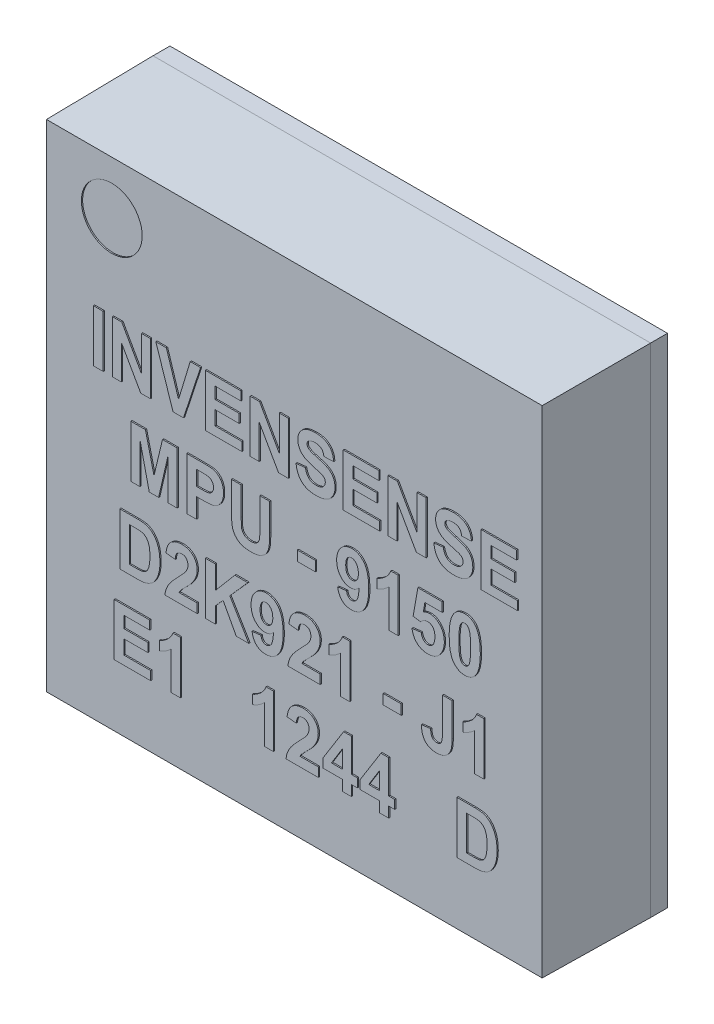
from build123d import *

# Parameters (mm, degrees)
SKETCH1_W                     = 4
SKETCH1_H                     = 4
BOSS_EXTRUDE1_DEPTH           = 0.864
BOSS_EXTRUDE1_TAPER           = 0.5
BOSS_EXTRUDE1_OTHER_WAY_DEPTH = 0.136
SKETCH2_W                     = 0.25
SKETCH2_H                     = 0.35
SKETCH2_W_2                   = 0.35
SKETCH2_H_2                   = 0.25
BOSS_EXTRUDE2_DEPTH           = 0.01
SKETCH3_R                     = 0.244364587
CUT_EXTRUDE1_DEPTH            = 0.01
SKETCH5_W                     = 0.0781
SKETCH5_H                     = 0.4191
SKETCH5_W_2                   = 0.1454
SKETCH5_H_2                   = 0.0802
BOSS_EXTRUDE3_DEPTH           = 0.01


with BuildPart() as part:
    # Sketch1 → Boss-Extrude1 (new body)
    with BuildSketch(Plane.XY):
        Rectangle(SKETCH1_W, SKETCH1_H)
    extrude(amount=BOSS_EXTRUDE1_DEPTH, taper=BOSS_EXTRUDE1_TAPER)

    # Sketch1 → Boss-Extrude1 other way (add)
    with BuildSketch(Plane.XY):
        Rectangle(SKETCH1_W, SKETCH1_H)
    extrude(amount=-BOSS_EXTRUDE1_OTHER_WAY_DEPTH)

    # Sketch2 → Boss-Extrude2 (add)
    with BuildSketch(Plane(origin=(0, 0, -0.136), x_dir=(-1, 0, 0), z_dir=(0, 0, -1))):
        with Locations((-0.75, -1.705)):
            Rectangle(SKETCH2_W, SKETCH2_H)
        with Locations((-1.25, -1.705)):
            Rectangle(SKETCH2_W, SKETCH2_H)
        with Locations((-0.25, -1.705)):
            Rectangle(SKETCH2_W, SKETCH2_H)
        with Locations((0.25, -1.705)):
            Rectangle(SKETCH2_W, SKETCH2_H)
        with Locations((0.75, -1.705)):
            Rectangle(SKETCH2_W, SKETCH2_H)
        with Locations((1.25, -1.705)):
            Rectangle(SKETCH2_W, SKETCH2_H)
        with Locations((-1.705, 0.75)):
            Rectangle(SKETCH2_W_2, SKETCH2_H_2)
        with Locations((-1.705, 1.25)):
            Rectangle(SKETCH2_W_2, SKETCH2_H_2)
        with Locations((-1.705, 0.25)):
            Rectangle(SKETCH2_W_2, SKETCH2_H_2)
        with Locations((-1.705, -0.25)):
            Rectangle(SKETCH2_W_2, SKETCH2_H_2)
        with Locations((-1.705, -0.75)):
            Rectangle(SKETCH2_W_2, SKETCH2_H_2)
        with Locations((-1.705, -1.25)):
            Rectangle(SKETCH2_W_2, SKETCH2_H_2)
        with Locations((0.75, 1.705)):
            Rectangle(SKETCH2_W, SKETCH2_H)
        with Locations((1.25, 1.705)):
            Rectangle(SKETCH2_W, SKETCH2_H)
        with Locations((0.25, 1.705)):
            Rectangle(SKETCH2_W, SKETCH2_H)
        with Locations((-0.25, 1.705)):
            Rectangle(SKETCH2_W, SKETCH2_H)
        with Locations((-0.75, 1.705)):
            Rectangle(SKETCH2_W, SKETCH2_H)
        with Locations((-1.25, 1.705)):
            Rectangle(SKETCH2_W, SKETCH2_H)
        with Locations((1.705, -0.75)):
            Rectangle(SKETCH2_W_2, SKETCH2_H_2)
        with Locations((1.705, -1.25)):
            Rectangle(SKETCH2_W_2, SKETCH2_H_2)
        with Locations((1.705, -0.25)):
            Rectangle(SKETCH2_W_2, SKETCH2_H_2)
        with Locations((1.705, 0.25)):
            Rectangle(SKETCH2_W_2, SKETCH2_H_2)
        with Locations((1.705, 0.75)):
            Rectangle(SKETCH2_W_2, SKETCH2_H_2)
        with Locations((1.705, 1.25)):
            Rectangle(SKETCH2_W_2, SKETCH2_H_2)
    extrude(amount=BOSS_EXTRUDE2_DEPTH)

    # Sketch3 → Cut-Extrude1 (cut)
    with BuildSketch(Plane.XY.offset(0.864)):
        with Locations((-1.467612488, 1.566522619)):
            Circle(SKETCH3_R)
    extrude(amount=-CUT_EXTRUDE1_DEPTH, mode=Mode.SUBTRACT)

    # Sketch5 → Boss-Extrude3 (add)
    # profile 1 of 34: a face of its own
    with BuildSketch(Plane.XY.offset(0.864)):
        with Locations((-1.56615, 0.68505)):
            Rectangle(SKETCH5_W, SKETCH5_H)
    # profile 2 of 34: a face of its own
    with BuildSketch(Plane.XY.offset(0.864)):
        Polygon((-1.453, 0.4755), (-1.453, 0.8946), (-1.3773, 0.8946), (-1.2186, 0.6138), (-1.2186, 0.8946), (-1.1464, 0.8946), (-1.1464, 0.4755), (-1.2245, 0.4755), (-1.3807, 0.751), (-1.3807, 0.4755), align=None)
    # profile 3 of 34: a face of its own
    with BuildSketch(Plane.XY.offset(0.864)):
        Polygon((-0.9652, 0.4755), (-1.1033, 0.8946), (-1.0189, 0.8946), (-0.9209, 0.5844), (-0.8269, 0.8946), (-0.7439, 0.8946), (-0.8811, 0.4755), align=None)
    # profile 4 of 34: a face of its own
    with BuildSketch(Plane.XY.offset(0.864)):
        Polygon((-0.7046, 0.4755), (-0.7046, 0.8946), (-0.419, 0.8946), (-0.419, 0.8238), (-0.6264, 0.8238), (-0.6264, 0.7307), (-0.4336, 0.7307), (-0.4336, 0.6599), (-0.6264, 0.6599), (-0.6264, 0.5463), (-0.4115, 0.5463), (-0.4115, 0.4755), align=None)
    # profile 5 of 34: a face of its own
    with BuildSketch(Plane.XY.offset(0.864)):
        Polygon((-0.3453, 0.4755), (-0.3453, 0.8946), (-0.2696, 0.8946), (-0.1109, 0.6138), (-0.1109, 0.8946), (-0.0387, 0.8946), (-0.0387, 0.4755), (-0.1168, 0.4755), (-0.273, 0.751), (-0.273, 0.4755), align=None)
    # profile 6 of 34: a face of its own
    with BuildSketch(Plane.XY.offset(0.864)):
        with BuildLine():
            Line((0.0234, 0.6113), (0.0993, 0.6195))
            add(Edge.make_bspline(
                [(0.0993, 0.6195), (0.1039, 0.5919), (0.1131, 0.5717), (0.127, 0.5587)],
                knots=[0.032258065, 0.032258065, 0.032258065, 0.032258065, 0.064516129, 0.064516129, 0.064516129, 0.064516129], degree=3))
            add(Edge.make_bspline(
                [(0.127, 0.5587), (0.1409, 0.5457), (0.1597, 0.5393), (0.1833, 0.5393)],
                knots=[0.064516129, 0.064516129, 0.064516129, 0.064516129, 0.096774194, 0.096774194, 0.096774194, 0.096774194], degree=3))
            add(Edge.make_bspline(
                [(0.1833, 0.5393), (0.2083, 0.5393), (0.2271, 0.5451), (0.2397, 0.5566)],
                knots=[0.096774194, 0.096774194, 0.096774194, 0.096774194, 0.129032258, 0.129032258, 0.129032258, 0.129032258], degree=3))
            add(Edge.make_bspline(
                [(0.2397, 0.5566), (0.2524, 0.5681), (0.2588, 0.5816), (0.2588, 0.597)],
                knots=[0.129032258, 0.129032258, 0.129032258, 0.129032258, 0.161290323, 0.161290323, 0.161290323, 0.161290323], degree=3))
            add(Edge.make_bspline(
                [(0.2588, 0.597), (0.2588, 0.6069), (0.2561, 0.6153), (0.2508, 0.6223)],
                knots=[0.161290323, 0.161290323, 0.161290323, 0.161290323, 0.193548387, 0.193548387, 0.193548387, 0.193548387], degree=3))
            add(Edge.make_bspline(
                [(0.2508, 0.6223), (0.2455, 0.6293), (0.2362, 0.6353), (0.2229, 0.6404)],
                knots=[0.193548387, 0.193548387, 0.193548387, 0.193548387, 0.225806452, 0.225806452, 0.225806452, 0.225806452], degree=3))
            add(Edge.make_bspline(
                [(0.2229, 0.6404), (0.2138, 0.6439), (0.1932, 0.6499), (0.1609, 0.6587)],
                knots=[0.225806452, 0.225806452, 0.225806452, 0.225806452, 0.258064516, 0.258064516, 0.258064516, 0.258064516], degree=3))
            add(Edge.make_bspline(
                [(0.1609, 0.6587), (0.1193, 0.67), (0.0901, 0.6839), (0.0733, 0.7004)],
                knots=[0.258064516, 0.258064516, 0.258064516, 0.258064516, 0.290322581, 0.290322581, 0.290322581, 0.290322581], degree=3))
            add(Edge.make_bspline(
                [(0.0733, 0.7004), (0.0497, 0.7235), (0.0379, 0.7517), (0.0379, 0.785)],
                knots=[0.290322581, 0.290322581, 0.290322581, 0.290322581, 0.322580645, 0.322580645, 0.322580645, 0.322580645], degree=3))
            add(Edge.make_bspline(
                [(0.0379, 0.785), (0.0379, 0.8063), (0.0435, 0.8264), (0.0545, 0.8451)],
                knots=[0.322580645, 0.322580645, 0.322580645, 0.322580645, 0.35483871, 0.35483871, 0.35483871, 0.35483871], degree=3))
            add(Edge.make_bspline(
                [(0.0545, 0.8451), (0.0656, 0.8637), (0.0817, 0.8779), (0.1025, 0.8876)],
                knots=[0.35483871, 0.35483871, 0.35483871, 0.35483871, 0.387096774, 0.387096774, 0.387096774, 0.387096774], degree=3))
            add(Edge.make_bspline(
                [(0.1025, 0.8876), (0.1235, 0.8974), (0.1486, 0.9023), (0.1783, 0.9023)],
                knots=[0.387096774, 0.387096774, 0.387096774, 0.387096774, 0.419354839, 0.419354839, 0.419354839, 0.419354839], degree=3))
            add(Edge.make_bspline(
                [(0.1783, 0.9023), (0.2265, 0.9023), (0.2628, 0.8906), (0.2871, 0.8673)],
                knots=[0.419354839, 0.419354839, 0.419354839, 0.419354839, 0.451612903, 0.451612903, 0.451612903, 0.451612903], degree=3))
            add(Edge.make_bspline(
                [(0.2871, 0.8673), (0.3116, 0.844), (0.3243, 0.813), (0.3256, 0.7741)],
                knots=[0.451612903, 0.451612903, 0.451612903, 0.451612903, 0.483870968, 0.483870968, 0.483870968, 0.483870968], degree=3))
            Line((0.3256, 0.7741), (0.2475, 0.7711))
            add(Edge.make_bspline(
                [(0.2475, 0.7711), (0.2442, 0.7928), (0.2371, 0.8083), (0.2262, 0.8178)],
                knots=[0.516129032, 0.516129032, 0.516129032, 0.516129032, 0.548387097, 0.548387097, 0.548387097, 0.548387097], degree=3))
            add(Edge.make_bspline(
                [(0.2262, 0.8178), (0.2154, 0.8272), (0.199, 0.832), (0.1773, 0.832)],
                knots=[0.548387097, 0.548387097, 0.548387097, 0.548387097, 0.580645161, 0.580645161, 0.580645161, 0.580645161], degree=3))
            add(Edge.make_bspline(
                [(0.1773, 0.832), (0.1548, 0.832), (0.1372, 0.8269), (0.1245, 0.8168)],
                knots=[0.580645161, 0.580645161, 0.580645161, 0.580645161, 0.612903226, 0.612903226, 0.612903226, 0.612903226], degree=3))
            add(Edge.make_bspline(
                [(0.1245, 0.8168), (0.1164, 0.8103), (0.1123, 0.8016), (0.1123, 0.7906)],
                knots=[0.612903226, 0.612903226, 0.612903226, 0.612903226, 0.64516129, 0.64516129, 0.64516129, 0.64516129], degree=3))
            add(Edge.make_bspline(
                [(0.1123, 0.7906), (0.1123, 0.7807), (0.1162, 0.7722), (0.1239, 0.7652)],
                knots=[0.64516129, 0.64516129, 0.64516129, 0.64516129, 0.677419355, 0.677419355, 0.677419355, 0.677419355], degree=3))
            add(Edge.make_bspline(
                [(0.1239, 0.7652), (0.1336, 0.7561), (0.1575, 0.7467), (0.1952, 0.737)],
                knots=[0.677419355, 0.677419355, 0.677419355, 0.677419355, 0.709677419, 0.709677419, 0.709677419, 0.709677419], degree=3))
            add(Edge.make_bspline(
                [(0.1952, 0.737), (0.233, 0.7273), (0.261, 0.7172), (0.279, 0.7068)],
                knots=[0.709677419, 0.709677419, 0.709677419, 0.709677419, 0.741935484, 0.741935484, 0.741935484, 0.741935484], degree=3))
            add(Edge.make_bspline(
                [(0.279, 0.7068), (0.2972, 0.6964), (0.3113, 0.6822), (0.3216, 0.6642)],
                knots=[0.741935484, 0.741935484, 0.741935484, 0.741935484, 0.774193548, 0.774193548, 0.774193548, 0.774193548], degree=3))
            add(Edge.make_bspline(
                [(0.3216, 0.6642), (0.3318, 0.6461), (0.3369, 0.6239), (0.3369, 0.5975)],
                knots=[0.774193548, 0.774193548, 0.774193548, 0.774193548, 0.806451613, 0.806451613, 0.806451613, 0.806451613], degree=3))
            add(Edge.make_bspline(
                [(0.3369, 0.5975), (0.3369, 0.5735), (0.3308, 0.5509), (0.3185, 0.5299)],
                knots=[0.806451613, 0.806451613, 0.806451613, 0.806451613, 0.838709677, 0.838709677, 0.838709677, 0.838709677], degree=3))
            add(Edge.make_bspline(
                [(0.3185, 0.5299), (0.3062, 0.509), (0.2889, 0.4934), (0.2664, 0.4832)],
                knots=[0.838709677, 0.838709677, 0.838709677, 0.838709677, 0.870967742, 0.870967742, 0.870967742, 0.870967742], degree=3))
            add(Edge.make_bspline(
                [(0.2664, 0.4832), (0.244, 0.473), (0.216, 0.4679), (0.1825, 0.4679)],
                knots=[0.870967742, 0.870967742, 0.870967742, 0.870967742, 0.903225806, 0.903225806, 0.903225806, 0.903225806], degree=3))
            add(Edge.make_bspline(
                [(0.1825, 0.4679), (0.1337, 0.4679), (0.0963, 0.4801), (0.0701, 0.5046)],
                knots=[0.903225806, 0.903225806, 0.903225806, 0.903225806, 0.935483871, 0.935483871, 0.935483871, 0.935483871], degree=3))
            add(Edge.make_bspline(
                [(0.0701, 0.5046), (0.044, 0.529), (0.0286, 0.5646), (0.0234, 0.6113)],
                knots=[0.935483871, 0.935483871, 0.935483871, 0.935483871, 1, 1, 1, 1], degree=3))
        make_face()
    # profile 7 of 34: a face of its own
    with BuildSketch(Plane.XY.offset(0.864)):
        Polygon((0.4031, 0.4755), (0.4031, 0.8946), (0.6887, 0.8946), (0.6887, 0.8238), (0.4813, 0.8238), (0.4813, 0.7307), (0.6741, 0.7307), (0.6741, 0.6599), (0.4813, 0.6599), (0.4813, 0.5463), (0.6962, 0.5463), (0.6962, 0.4755), align=None)
    # profile 8 of 34: a face of its own
    with BuildSketch(Plane.XY.offset(0.864)):
        Polygon((0.7625, 0.4755), (0.7625, 0.8946), (0.8382, 0.8946), (0.9969, 0.6138), (0.9969, 0.8946), (1.0691, 0.8946), (1.0691, 0.4755), (0.991, 0.4755), (0.8348, 0.751), (0.8348, 0.4755), align=None)
    # profile 9 of 34: a face of its own
    with BuildSketch(Plane.XY.offset(0.864)):
        with BuildLine():
            Line((1.1312, 0.6113), (1.2071, 0.6195))
            add(Edge.make_bspline(
                [(1.2071, 0.6195), (1.2117, 0.5919), (1.2209, 0.5717), (1.2348, 0.5587)],
                knots=[0.032258065, 0.032258065, 0.032258065, 0.032258065, 0.064516129, 0.064516129, 0.064516129, 0.064516129], degree=3))
            add(Edge.make_bspline(
                [(1.2348, 0.5587), (1.2487, 0.5457), (1.2675, 0.5393), (1.2911, 0.5393)],
                knots=[0.064516129, 0.064516129, 0.064516129, 0.064516129, 0.096774194, 0.096774194, 0.096774194, 0.096774194], degree=3))
            add(Edge.make_bspline(
                [(1.2911, 0.5393), (1.3161, 0.5393), (1.3349, 0.5451), (1.3475, 0.5566)],
                knots=[0.096774194, 0.096774194, 0.096774194, 0.096774194, 0.129032258, 0.129032258, 0.129032258, 0.129032258], degree=3))
            add(Edge.make_bspline(
                [(1.3475, 0.5566), (1.3602, 0.5681), (1.3666, 0.5816), (1.3666, 0.597)],
                knots=[0.129032258, 0.129032258, 0.129032258, 0.129032258, 0.161290323, 0.161290323, 0.161290323, 0.161290323], degree=3))
            add(Edge.make_bspline(
                [(1.3666, 0.597), (1.3666, 0.6069), (1.3639, 0.6153), (1.3586, 0.6223)],
                knots=[0.161290323, 0.161290323, 0.161290323, 0.161290323, 0.193548387, 0.193548387, 0.193548387, 0.193548387], degree=3))
            add(Edge.make_bspline(
                [(1.3586, 0.6223), (1.3533, 0.6293), (1.344, 0.6353), (1.3307, 0.6404)],
                knots=[0.193548387, 0.193548387, 0.193548387, 0.193548387, 0.225806452, 0.225806452, 0.225806452, 0.225806452], degree=3))
            add(Edge.make_bspline(
                [(1.3307, 0.6404), (1.3216, 0.6439), (1.301, 0.6499), (1.2687, 0.6587)],
                knots=[0.225806452, 0.225806452, 0.225806452, 0.225806452, 0.258064516, 0.258064516, 0.258064516, 0.258064516], degree=3))
            add(Edge.make_bspline(
                [(1.2687, 0.6587), (1.2271, 0.67), (1.1979, 0.6839), (1.1811, 0.7004)],
                knots=[0.258064516, 0.258064516, 0.258064516, 0.258064516, 0.290322581, 0.290322581, 0.290322581, 0.290322581], degree=3))
            add(Edge.make_bspline(
                [(1.1811, 0.7004), (1.1575, 0.7235), (1.1457, 0.7517), (1.1457, 0.785)],
                knots=[0.290322581, 0.290322581, 0.290322581, 0.290322581, 0.322580645, 0.322580645, 0.322580645, 0.322580645], degree=3))
            add(Edge.make_bspline(
                [(1.1457, 0.785), (1.1457, 0.8063), (1.1513, 0.8264), (1.1623, 0.8451)],
                knots=[0.322580645, 0.322580645, 0.322580645, 0.322580645, 0.35483871, 0.35483871, 0.35483871, 0.35483871], degree=3))
            add(Edge.make_bspline(
                [(1.1623, 0.8451), (1.1734, 0.8637), (1.1895, 0.8779), (1.2103, 0.8876)],
                knots=[0.35483871, 0.35483871, 0.35483871, 0.35483871, 0.387096774, 0.387096774, 0.387096774, 0.387096774], degree=3))
            add(Edge.make_bspline(
                [(1.2103, 0.8876), (1.2313, 0.8974), (1.2564, 0.9023), (1.2861, 0.9023)],
                knots=[0.387096774, 0.387096774, 0.387096774, 0.387096774, 0.419354839, 0.419354839, 0.419354839, 0.419354839], degree=3))
            add(Edge.make_bspline(
                [(1.2861, 0.9023), (1.3343, 0.9023), (1.3706, 0.8906), (1.3949, 0.8673)],
                knots=[0.419354839, 0.419354839, 0.419354839, 0.419354839, 0.451612903, 0.451612903, 0.451612903, 0.451612903], degree=3))
            add(Edge.make_bspline(
                [(1.3949, 0.8673), (1.4194, 0.844), (1.4321, 0.813), (1.4334, 0.7741)],
                knots=[0.451612903, 0.451612903, 0.451612903, 0.451612903, 0.483870968, 0.483870968, 0.483870968, 0.483870968], degree=3))
            Line((1.4334, 0.7741), (1.3553, 0.7711))
            add(Edge.make_bspline(
                [(1.3553, 0.7711), (1.352, 0.7928), (1.3449, 0.8083), (1.334, 0.8178)],
                knots=[0.516129032, 0.516129032, 0.516129032, 0.516129032, 0.548387097, 0.548387097, 0.548387097, 0.548387097], degree=3))
            add(Edge.make_bspline(
                [(1.334, 0.8178), (1.3232, 0.8272), (1.3068, 0.832), (1.2851, 0.832)],
                knots=[0.548387097, 0.548387097, 0.548387097, 0.548387097, 0.580645161, 0.580645161, 0.580645161, 0.580645161], degree=3))
            add(Edge.make_bspline(
                [(1.2851, 0.832), (1.2626, 0.832), (1.245, 0.8269), (1.2323, 0.8168)],
                knots=[0.580645161, 0.580645161, 0.580645161, 0.580645161, 0.612903226, 0.612903226, 0.612903226, 0.612903226], degree=3))
            add(Edge.make_bspline(
                [(1.2323, 0.8168), (1.2242, 0.8103), (1.2201, 0.8016), (1.2201, 0.7906)],
                knots=[0.612903226, 0.612903226, 0.612903226, 0.612903226, 0.64516129, 0.64516129, 0.64516129, 0.64516129], degree=3))
            add(Edge.make_bspline(
                [(1.2201, 0.7906), (1.2201, 0.7807), (1.224, 0.7722), (1.2317, 0.7652)],
                knots=[0.64516129, 0.64516129, 0.64516129, 0.64516129, 0.677419355, 0.677419355, 0.677419355, 0.677419355], degree=3))
            add(Edge.make_bspline(
                [(1.2317, 0.7652), (1.2414, 0.7561), (1.2653, 0.7467), (1.303, 0.737)],
                knots=[0.677419355, 0.677419355, 0.677419355, 0.677419355, 0.709677419, 0.709677419, 0.709677419, 0.709677419], degree=3))
            add(Edge.make_bspline(
                [(1.303, 0.737), (1.3408, 0.7273), (1.3688, 0.7172), (1.3868, 0.7068)],
                knots=[0.709677419, 0.709677419, 0.709677419, 0.709677419, 0.741935484, 0.741935484, 0.741935484, 0.741935484], degree=3))
            add(Edge.make_bspline(
                [(1.3868, 0.7068), (1.405, 0.6964), (1.4191, 0.6822), (1.4294, 0.6642)],
                knots=[0.741935484, 0.741935484, 0.741935484, 0.741935484, 0.774193548, 0.774193548, 0.774193548, 0.774193548], degree=3))
            add(Edge.make_bspline(
                [(1.4294, 0.6642), (1.4396, 0.6461), (1.4447, 0.6239), (1.4447, 0.5975)],
                knots=[0.774193548, 0.774193548, 0.774193548, 0.774193548, 0.806451613, 0.806451613, 0.806451613, 0.806451613], degree=3))
            add(Edge.make_bspline(
                [(1.4447, 0.5975), (1.4447, 0.5735), (1.4386, 0.5509), (1.4263, 0.5299)],
                knots=[0.806451613, 0.806451613, 0.806451613, 0.806451613, 0.838709677, 0.838709677, 0.838709677, 0.838709677], degree=3))
            add(Edge.make_bspline(
                [(1.4263, 0.5299), (1.414, 0.509), (1.3967, 0.4934), (1.3742, 0.4832)],
                knots=[0.838709677, 0.838709677, 0.838709677, 0.838709677, 0.870967742, 0.870967742, 0.870967742, 0.870967742], degree=3))
            add(Edge.make_bspline(
                [(1.3742, 0.4832), (1.3518, 0.473), (1.3238, 0.4679), (1.2903, 0.4679)],
                knots=[0.870967742, 0.870967742, 0.870967742, 0.870967742, 0.903225806, 0.903225806, 0.903225806, 0.903225806], degree=3))
            add(Edge.make_bspline(
                [(1.2903, 0.4679), (1.2415, 0.4679), (1.2041, 0.4801), (1.1779, 0.5046)],
                knots=[0.903225806, 0.903225806, 0.903225806, 0.903225806, 0.935483871, 0.935483871, 0.935483871, 0.935483871], degree=3))
            add(Edge.make_bspline(
                [(1.1779, 0.5046), (1.1518, 0.529), (1.1364, 0.5646), (1.1312, 0.6113)],
                knots=[0.935483871, 0.935483871, 0.935483871, 0.935483871, 1, 1, 1, 1], degree=3))
        make_face()
    # profile 10 of 34: a face of its own
    with BuildSketch(Plane.XY.offset(0.864)):
        Polygon((1.5109, 0.4755), (1.5109, 0.8946), (1.7965, 0.8946), (1.7965, 0.8238), (1.5891, 0.8238), (1.5891, 0.7307), (1.7819, 0.7307), (1.7819, 0.6599), (1.5891, 0.6599), (1.5891, 0.5463), (1.804, 0.5463), (1.804, 0.4755), align=None)
    # profile 11 of 34: a face of its own
    with BuildSketch(Plane.XY.offset(0.864)):
        Polygon((-1.3043, -0.1785), (-1.3043, 0.2406), (-1.1873, 0.2406), (-1.1182, -0.0452), (-1.0498, 0.2406), (-0.9326, 0.2406), (-0.9326, -0.1785), (-1.0048, -0.1785), (-1.005, 0.1515), (-1.0811, -0.1785), (-1.1562, -0.1785), (-1.2319, 0.1515), (-1.2321, -0.1785), align=None)
    # profile 12 of 34: a face of its own
    with BuildSketch(Plane.XY.offset(0.864)):
        with BuildLine():
            Line((-0.8546, -0.1785), (-0.8546, 0.2406))
            Line((-0.8546, 0.2406), (-0.7297, 0.2406))
            add(Edge.make_bspline(
                [(-0.7297, 0.2406), (-0.6823, 0.2406), (-0.6516, 0.2386), (-0.6372, 0.2344)],
                knots=[0.153846154, 0.153846154, 0.153846154, 0.153846154, 0.230769231, 0.230769231, 0.230769231, 0.230769231], degree=3))
            add(Edge.make_bspline(
                [(-0.6372, 0.2344), (-0.6151, 0.2281), (-0.5966, 0.2144), (-0.5817, 0.1933)],
                knots=[0.230769231, 0.230769231, 0.230769231, 0.230769231, 0.307692308, 0.307692308, 0.307692308, 0.307692308], degree=3))
            add(Edge.make_bspline(
                [(-0.5817, 0.1933), (-0.5668, 0.1723), (-0.5594, 0.145), (-0.5594, 0.1117)],
                knots=[0.307692308, 0.307692308, 0.307692308, 0.307692308, 0.384615385, 0.384615385, 0.384615385, 0.384615385], degree=3))
            add(Edge.make_bspline(
                [(-0.5594, 0.1117), (-0.5594, 0.0859), (-0.5636, 0.0643), (-0.5722, 0.0468)],
                knots=[0.384615385, 0.384615385, 0.384615385, 0.384615385, 0.461538462, 0.461538462, 0.461538462, 0.461538462], degree=3))
            add(Edge.make_bspline(
                [(-0.5722, 0.0468), (-0.5808, 0.0292), (-0.5917, 0.0155), (-0.6048, 0.0054)],
                knots=[0.461538462, 0.461538462, 0.461538462, 0.461538462, 0.538461538, 0.538461538, 0.538461538, 0.538461538], degree=3))
            add(Edge.make_bspline(
                [(-0.6048, 0.0054), (-0.6181, -0.0045), (-0.6315, -0.0112), (-0.6451, -0.0144)],
                knots=[0.538461538, 0.538461538, 0.538461538, 0.538461538, 0.615384615, 0.615384615, 0.615384615, 0.615384615], degree=3))
            add(Edge.make_bspline(
                [(-0.6451, -0.0144), (-0.6637, -0.0184), (-0.6906, -0.0204), (-0.7258, -0.0204)],
                knots=[0.615384615, 0.615384615, 0.615384615, 0.615384615, 0.692307692, 0.692307692, 0.692307692, 0.692307692], degree=3))
            Line((-0.7258, -0.0204), (-0.7764, -0.0204))
            Line((-0.7764, -0.0204), (-0.7764, -0.1785))
            Line((-0.7764, -0.1785), (-0.8546, -0.1785))
        make_face()
        with BuildLine():
            Line((-0.7764, 0.1698), (-0.7764, 0.0504))
            Line((-0.7764, 0.0504), (-0.7339, 0.0504))
            add(Edge.make_bspline(
                [(-0.7339, 0.0504), (-0.7034, 0.0504), (-0.6829, 0.0526), (-0.6726, 0.057)],
                knots=[0.2, 0.2, 0.2, 0.2, 0.3, 0.3, 0.3, 0.3], degree=3))
            add(Edge.make_bspline(
                [(-0.6726, 0.057), (-0.6623, 0.0614), (-0.6542, 0.0682), (-0.6484, 0.0777)],
                knots=[0.3, 0.3, 0.3, 0.3, 0.4, 0.4, 0.4, 0.4], degree=3))
            add(Edge.make_bspline(
                [(-0.6484, 0.0777), (-0.6426, 0.0871), (-0.6396, 0.0979), (-0.6396, 0.1104)],
                knots=[0.4, 0.4, 0.4, 0.4, 0.5, 0.5, 0.5, 0.5], degree=3))
            add(Edge.make_bspline(
                [(-0.6396, 0.1104), (-0.6396, 0.1257), (-0.6437, 0.1383), (-0.6519, 0.1483)],
                knots=[0.5, 0.5, 0.5, 0.5, 0.6, 0.6, 0.6, 0.6], degree=3))
            add(Edge.make_bspline(
                [(-0.6519, 0.1483), (-0.6601, 0.1582), (-0.6705, 0.1644), (-0.6831, 0.167)],
                knots=[0.6, 0.6, 0.6, 0.6, 0.7, 0.7, 0.7, 0.7], degree=3))
            add(Edge.make_bspline(
                [(-0.6831, 0.167), (-0.6924, 0.1688), (-0.711, 0.1698), (-0.739, 0.1698)],
                knots=[0.7, 0.7, 0.7, 0.7, 0.8, 0.8, 0.8, 0.8], degree=3))
            Line((-0.739, 0.1698), (-0.7764, 0.1698))
        make_face(mode=Mode.SUBTRACT)
    # profile 13 of 34: a face of its own
    with BuildSketch(Plane.XY.offset(0.864)):
        with BuildLine():
            Line((-0.4953, 0.2406), (-0.4171, 0.2406))
            Line((-0.4171, 0.2406), (-0.4171, 0.0135))
            add(Edge.make_bspline(
                [(-0.4171, 0.0135), (-0.4171, -0.0226), (-0.4161, -0.0459), (-0.4143, -0.0565)],
                knots=[0.095238095, 0.095238095, 0.095238095, 0.095238095, 0.142857143, 0.142857143, 0.142857143, 0.142857143], degree=3))
            add(Edge.make_bspline(
                [(-0.4143, -0.0565), (-0.411, -0.0737), (-0.4032, -0.0876), (-0.3907, -0.0979)],
                knots=[0.142857143, 0.142857143, 0.142857143, 0.142857143, 0.19047619, 0.19047619, 0.19047619, 0.19047619], degree=3))
            add(Edge.make_bspline(
                [(-0.3907, -0.0979), (-0.3782, -0.1083), (-0.3613, -0.1135), (-0.3398, -0.1135)],
                knots=[0.19047619, 0.19047619, 0.19047619, 0.19047619, 0.238095238, 0.238095238, 0.238095238, 0.238095238], degree=3))
            add(Edge.make_bspline(
                [(-0.3398, -0.1135), (-0.3179, -0.1135), (-0.3014, -0.1086), (-0.2902, -0.0988)],
                knots=[0.238095238, 0.238095238, 0.238095238, 0.238095238, 0.285714286, 0.285714286, 0.285714286, 0.285714286], degree=3))
            add(Edge.make_bspline(
                [(-0.2902, -0.0988), (-0.2791, -0.0889), (-0.2725, -0.0769), (-0.2703, -0.0626)],
                knots=[0.285714286, 0.285714286, 0.285714286, 0.285714286, 0.333333333, 0.333333333, 0.333333333, 0.333333333], degree=3))
            add(Edge.make_bspline(
                [(-0.2703, -0.0626), (-0.268, -0.0482), (-0.2669, -0.0245), (-0.2669, 0.0086)],
                knots=[0.333333333, 0.333333333, 0.333333333, 0.333333333, 0.380952381, 0.380952381, 0.380952381, 0.380952381], degree=3))
            Line((-0.2669, 0.0086), (-0.2669, 0.2406))
            Line((-0.2669, 0.2406), (-0.1887, 0.2406))
            Line((-0.1887, 0.2406), (-0.1887, 0.0202))
            add(Edge.make_bspline(
                [(-0.1887, 0.0202), (-0.1887, -0.0301), (-0.1908, -0.0657), (-0.195, -0.0865)],
                knots=[0.523809524, 0.523809524, 0.523809524, 0.523809524, 0.571428571, 0.571428571, 0.571428571, 0.571428571], degree=3))
            add(Edge.make_bspline(
                [(-0.195, -0.0865), (-0.1992, -0.1073), (-0.207, -0.1248), (-0.2183, -0.1392)],
                knots=[0.571428571, 0.571428571, 0.571428571, 0.571428571, 0.619047619, 0.619047619, 0.619047619, 0.619047619], degree=3))
            add(Edge.make_bspline(
                [(-0.2183, -0.1392), (-0.2295, -0.1535), (-0.2446, -0.1648), (-0.2634, -0.1733)],
                knots=[0.619047619, 0.619047619, 0.619047619, 0.619047619, 0.666666667, 0.666666667, 0.666666667, 0.666666667], degree=3))
            add(Edge.make_bspline(
                [(-0.2634, -0.1733), (-0.2823, -0.1818), (-0.307, -0.1861), (-0.3374, -0.1861)],
                knots=[0.666666667, 0.666666667, 0.666666667, 0.666666667, 0.714285714, 0.714285714, 0.714285714, 0.714285714], degree=3))
            add(Edge.make_bspline(
                [(-0.3374, -0.1861), (-0.3741, -0.1861), (-0.402, -0.1815), (-0.4209, -0.1723)],
                knots=[0.714285714, 0.714285714, 0.714285714, 0.714285714, 0.761904762, 0.761904762, 0.761904762, 0.761904762], degree=3))
            add(Edge.make_bspline(
                [(-0.4209, -0.1723), (-0.4399, -0.163), (-0.4549, -0.151), (-0.4659, -0.1362)],
                knots=[0.761904762, 0.761904762, 0.761904762, 0.761904762, 0.80952381, 0.80952381, 0.80952381, 0.80952381], degree=3))
            add(Edge.make_bspline(
                [(-0.4659, -0.1362), (-0.477, -0.1213), (-0.4841, -0.1059), (-0.4876, -0.0896)],
                knots=[0.80952381, 0.80952381, 0.80952381, 0.80952381, 0.857142857, 0.857142857, 0.857142857, 0.857142857], degree=3))
            add(Edge.make_bspline(
                [(-0.4876, -0.0896), (-0.4927, -0.0656), (-0.4953, -0.0301), (-0.4953, 0.0168)],
                knots=[0.857142857, 0.857142857, 0.857142857, 0.857142857, 0.904761905, 0.904761905, 0.904761905, 0.904761905], degree=3))
            Line((-0.4953, 0.0168), (-0.4953, 0.2406))
        make_face()
    # profile 14 of 34: a face of its own
    with BuildSketch(Plane.XY.offset(0.864)):
        with Locations((0.107, -0.0266)):
            Rectangle(SKETCH5_W_2, SKETCH5_H_2)
    # profile 15 of 34: a face of its own
    with BuildSketch(Plane.XY.offset(0.864)):
        with BuildLine():
            Line((0.3584, -0.0811), (0.4301, -0.0725))
            add(Edge.make_bspline(
                [(0.4301, -0.0725), (0.4318, -0.0884), (0.4364, -0.1003), (0.4437, -0.1079)],
                knots=[0.058823529, 0.058823529, 0.058823529, 0.058823529, 0.117647059, 0.117647059, 0.117647059, 0.117647059], degree=3))
            add(Edge.make_bspline(
                [(0.4437, -0.1079), (0.4509, -0.1156), (0.4606, -0.1194), (0.4726, -0.1194)],
                knots=[0.117647059, 0.117647059, 0.117647059, 0.117647059, 0.176470588, 0.176470588, 0.176470588, 0.176470588], degree=3))
            add(Edge.make_bspline(
                [(0.4726, -0.1194), (0.4877, -0.1194), (0.5006, -0.1117), (0.5112, -0.0963)],
                knots=[0.176470588, 0.176470588, 0.176470588, 0.176470588, 0.235294118, 0.235294118, 0.235294118, 0.235294118], degree=3))
            add(Edge.make_bspline(
                [(0.5112, -0.0963), (0.5218, -0.081), (0.5285, -0.0492), (0.5314, -0.0011)],
                knots=[0.235294118, 0.235294118, 0.235294118, 0.235294118, 0.294117647, 0.294117647, 0.294117647, 0.294117647], degree=3))
            add(Edge.make_bspline(
                [(0.5314, -0.0011), (0.5129, -0.0245), (0.4898, -0.0362), (0.4618, -0.0362)],
                knots=[0.294117647, 0.294117647, 0.294117647, 0.294117647, 0.352941176, 0.352941176, 0.352941176, 0.352941176], degree=3))
            add(Edge.make_bspline(
                [(0.4618, -0.0362), (0.4315, -0.0362), (0.4053, -0.0236), (0.3833, 0.0019)],
                knots=[0.352941176, 0.352941176, 0.352941176, 0.352941176, 0.411764706, 0.411764706, 0.411764706, 0.411764706], degree=3))
            add(Edge.make_bspline(
                [(0.3833, 0.0019), (0.3613, 0.0274), (0.3503, 0.0604), (0.3503, 0.1012)],
                knots=[0.411764706, 0.411764706, 0.411764706, 0.411764706, 0.470588235, 0.470588235, 0.470588235, 0.470588235], degree=3))
            add(Edge.make_bspline(
                [(0.3503, 0.1012), (0.3503, 0.1438), (0.3619, 0.178), (0.3852, 0.204)],
                knots=[0.470588235, 0.470588235, 0.470588235, 0.470588235, 0.529411765, 0.529411765, 0.529411765, 0.529411765], degree=3))
            add(Edge.make_bspline(
                [(0.3852, 0.204), (0.4085, 0.23), (0.4381, 0.243), (0.474, 0.243)],
                knots=[0.529411765, 0.529411765, 0.529411765, 0.529411765, 0.588235294, 0.588235294, 0.588235294, 0.588235294], degree=3))
            add(Edge.make_bspline(
                [(0.474, 0.243), (0.513, 0.243), (0.5452, 0.2265), (0.5703, 0.1936)],
                knots=[0.588235294, 0.588235294, 0.588235294, 0.588235294, 0.647058824, 0.647058824, 0.647058824, 0.647058824], degree=3))
            add(Edge.make_bspline(
                [(0.5703, 0.1936), (0.5953, 0.1606), (0.6079, 0.1065), (0.6079, 0.031)],
                knots=[0.647058824, 0.647058824, 0.647058824, 0.647058824, 0.705882353, 0.705882353, 0.705882353, 0.705882353], degree=3))
            add(Edge.make_bspline(
                [(0.6079, 0.031), (0.6079, -0.0457), (0.5948, -0.1011), (0.5688, -0.1351)],
                knots=[0.705882353, 0.705882353, 0.705882353, 0.705882353, 0.764705882, 0.764705882, 0.764705882, 0.764705882], degree=3))
            add(Edge.make_bspline(
                [(0.5688, -0.1351), (0.5428, -0.1691), (0.5088, -0.1861), (0.467, -0.1861)],
                knots=[0.764705882, 0.764705882, 0.764705882, 0.764705882, 0.823529412, 0.823529412, 0.823529412, 0.823529412], degree=3))
            add(Edge.make_bspline(
                [(0.467, -0.1861), (0.4369, -0.1861), (0.4126, -0.1773), (0.3941, -0.1598)],
                knots=[0.823529412, 0.823529412, 0.823529412, 0.823529412, 0.882352941, 0.882352941, 0.882352941, 0.882352941], degree=3))
            add(Edge.make_bspline(
                [(0.3941, -0.1598), (0.3756, -0.1423), (0.3637, -0.1161), (0.3584, -0.0811)],
                knots=[0.882352941, 0.882352941, 0.882352941, 0.882352941, 1, 1, 1, 1], degree=3))
        make_face()
        with BuildLine():
            add(Edge.make_bspline(
                [(0.5249, 0.0947), (0.5249, 0.1205), (0.5195, 0.1406), (0.5084, 0.1549)],
                knots=[0, 0, 0, 0, 0.111111111, 0.111111111, 0.111111111, 0.111111111], degree=3))
            add(Edge.make_bspline(
                [(0.5084, 0.1549), (0.4976, 0.1691), (0.485, 0.1763), (0.4706, 0.1763)],
                knots=[0.111111111, 0.111111111, 0.111111111, 0.111111111, 0.222222222, 0.222222222, 0.222222222, 0.222222222], degree=3))
            add(Edge.make_bspline(
                [(0.4706, 0.1763), (0.4569, 0.1763), (0.4457, 0.1704), (0.4367, 0.1587)],
                knots=[0.222222222, 0.222222222, 0.222222222, 0.222222222, 0.333333333, 0.333333333, 0.333333333, 0.333333333], degree=3))
            add(Edge.make_bspline(
                [(0.4367, 0.1587), (0.4276, 0.147), (0.4231, 0.1279), (0.4231, 0.1013)],
                knots=[0.333333333, 0.333333333, 0.333333333, 0.333333333, 0.444444444, 0.444444444, 0.444444444, 0.444444444], degree=3))
            add(Edge.make_bspline(
                [(0.4231, 0.1013), (0.4231, 0.0743), (0.428, 0.0545), (0.4379, 0.0418)],
                knots=[0.444444444, 0.444444444, 0.444444444, 0.444444444, 0.555555556, 0.555555556, 0.555555556, 0.555555556], degree=3))
            add(Edge.make_bspline(
                [(0.4379, 0.0418), (0.4476, 0.0292), (0.4599, 0.0229), (0.4746, 0.0229)],
                knots=[0.555555556, 0.555555556, 0.555555556, 0.555555556, 0.666666667, 0.666666667, 0.666666667, 0.666666667], degree=3))
            add(Edge.make_bspline(
                [(0.4746, 0.0229), (0.4887, 0.0229), (0.5007, 0.0289), (0.5104, 0.0411)],
                knots=[0.666666667, 0.666666667, 0.666666667, 0.666666667, 0.777777778, 0.777777778, 0.777777778, 0.777777778], degree=3))
            add(Edge.make_bspline(
                [(0.5104, 0.0411), (0.52, 0.0533), (0.5249, 0.0712), (0.5249, 0.0947)],
                knots=[0.777777778, 0.777777778, 0.777777778, 0.777777778, 1, 1, 1, 1], degree=3))
        make_face(mode=Mode.SUBTRACT)
    # profile 16 of 34: a face of its own
    with BuildSketch(Plane.XY.offset(0.864)):
        with BuildLine():
            Line((0.8445, -0.1785), (0.7707, -0.1785))
            Line((0.7707, -0.1785), (0.7707, 0.1249))
            add(Edge.make_bspline(
                [(0.7707, 0.1249), (0.7437, 0.0974), (0.712, 0.077), (0.6753, 0.0639)],
                knots=[0.222222222, 0.222222222, 0.222222222, 0.222222222, 0.333333333, 0.333333333, 0.333333333, 0.333333333], degree=3))
            Line((0.6753, 0.0639), (0.6753, 0.137))
            add(Edge.make_bspline(
                [(0.6753, 0.137), (0.6946, 0.1439), (0.7156, 0.1568), (0.738, 0.1761)],
                knots=[0.444444444, 0.444444444, 0.444444444, 0.444444444, 0.555555556, 0.555555556, 0.555555556, 0.555555556], degree=3))
            add(Edge.make_bspline(
                [(0.738, 0.1761), (0.7606, 0.1952), (0.7761, 0.2175), (0.7846, 0.243)],
                knots=[0.555555556, 0.555555556, 0.555555556, 0.555555556, 0.666666667, 0.666666667, 0.666666667, 0.666666667], degree=3))
            Line((0.7846, 0.243), (0.8445, 0.243))
            Line((0.8445, 0.243), (0.8445, -0.1785))
        make_face()
    # profile 17 of 34: a face of its own
    with BuildSketch(Plane.XY.offset(0.864)):
        with BuildLine():
            Line((0.9562, -0.0709), (1.03, -0.0626))
            add(Edge.make_bspline(
                [(1.03, -0.0626), (1.0321, -0.0807), (1.0383, -0.0952), (1.0487, -0.1058)],
                knots=[0.045454545, 0.045454545, 0.045454545, 0.045454545, 0.090909091, 0.090909091, 0.090909091, 0.090909091], degree=3))
            add(Edge.make_bspline(
                [(1.0487, -0.1058), (1.0591, -0.1164), (1.0709, -0.1217), (1.0845, -0.1217)],
                knots=[0.090909091, 0.090909091, 0.090909091, 0.090909091, 0.136363636, 0.136363636, 0.136363636, 0.136363636], degree=3))
            add(Edge.make_bspline(
                [(1.0845, -0.1217), (1.1, -0.1217), (1.1131, -0.1149), (1.1238, -0.1011)],
                knots=[0.136363636, 0.136363636, 0.136363636, 0.136363636, 0.181818182, 0.181818182, 0.181818182, 0.181818182], degree=3))
            add(Edge.make_bspline(
                [(1.1238, -0.1011), (1.1344, -0.0874), (1.1399, -0.0667), (1.1399, -0.0391)],
                knots=[0.181818182, 0.181818182, 0.181818182, 0.181818182, 0.227272727, 0.227272727, 0.227272727, 0.227272727], degree=3))
            add(Edge.make_bspline(
                [(1.1399, -0.0391), (1.1399, -0.0131), (1.1345, 0.0063), (1.1238, 0.0193)],
                knots=[0.227272727, 0.227272727, 0.227272727, 0.227272727, 0.272727273, 0.272727273, 0.272727273, 0.272727273], degree=3))
            add(Edge.make_bspline(
                [(1.1238, 0.0193), (1.1133, 0.0322), (1.0995, 0.0387), (1.0823, 0.0387)],
                knots=[0.272727273, 0.272727273, 0.272727273, 0.272727273, 0.318181818, 0.318181818, 0.318181818, 0.318181818], degree=3))
            add(Edge.make_bspline(
                [(1.0823, 0.0387), (1.0611, 0.0387), (1.0419, 0.0285), (1.0251, 0.0082)],
                knots=[0.318181818, 0.318181818, 0.318181818, 0.318181818, 0.363636364, 0.363636364, 0.363636364, 0.363636364], degree=3))
            Line((1.0251, 0.0082), (0.9653, 0.0176))
            Line((0.9653, 0.0176), (1.003, 0.2354))
            Line((1.003, 0.2354), (1.1986, 0.2354))
            Line((1.1986, 0.2354), (1.1986, 0.1604))
            Line((1.1986, 0.1604), (1.0592, 0.1604))
            Line((1.0592, 0.1604), (1.0475, 0.0891))
            add(Edge.make_bspline(
                [(1.0475, 0.0891), (1.0638, 0.098), (1.0808, 0.1025), (1.098, 0.1025)],
                knots=[0.636363636, 0.636363636, 0.636363636, 0.636363636, 0.681818182, 0.681818182, 0.681818182, 0.681818182], degree=3))
            add(Edge.make_bspline(
                [(1.098, 0.1025), (1.1308, 0.1025), (1.1587, 0.0895), (1.1814, 0.0635)],
                knots=[0.681818182, 0.681818182, 0.681818182, 0.681818182, 0.727272727, 0.727272727, 0.727272727, 0.727272727], degree=3))
            add(Edge.make_bspline(
                [(1.1814, 0.0635), (1.2044, 0.0375), (1.2158, 0.0038), (1.2158, -0.0378)],
                knots=[0.727272727, 0.727272727, 0.727272727, 0.727272727, 0.772727273, 0.772727273, 0.772727273, 0.772727273], degree=3))
            add(Edge.make_bspline(
                [(1.2158, -0.0378), (1.2158, -0.0724), (1.2066, -0.1033), (1.1882, -0.1305)],
                knots=[0.772727273, 0.772727273, 0.772727273, 0.772727273, 0.818181818, 0.818181818, 0.818181818, 0.818181818], degree=3))
            add(Edge.make_bspline(
                [(1.1882, -0.1305), (1.163, -0.1676), (1.1282, -0.1861), (1.0836, -0.1861)],
                knots=[0.818181818, 0.818181818, 0.818181818, 0.818181818, 0.863636364, 0.863636364, 0.863636364, 0.863636364], degree=3))
            add(Edge.make_bspline(
                [(1.0836, -0.1861), (1.048, -0.1861), (1.0189, -0.1757), (0.9965, -0.1549)],
                knots=[0.863636364, 0.863636364, 0.863636364, 0.863636364, 0.909090909, 0.909090909, 0.909090909, 0.909090909], degree=3))
            add(Edge.make_bspline(
                [(0.9965, -0.1549), (0.9739, -0.134), (0.9605, -0.1061), (0.9562, -0.0709)],
                knots=[0.909090909, 0.909090909, 0.909090909, 0.909090909, 1, 1, 1, 1], degree=3))
        make_face()
    # profile 18 of 34: a face of its own
    with BuildSketch(Plane.XY.offset(0.864)):
        with BuildLine():
            Line((-1.3935, -0.4134), (-1.2514, -0.4134))
            add(Edge.make_bspline(
                [(-1.2514, -0.4134), (-1.2194, -0.4134), (-1.1949, -0.416), (-1.1781, -0.4214)],
                knots=[0.083333333, 0.083333333, 0.083333333, 0.083333333, 0.166666667, 0.166666667, 0.166666667, 0.166666667], degree=3))
            add(Edge.make_bspline(
                [(-1.1781, -0.4214), (-1.1556, -0.4286), (-1.1362, -0.4415), (-1.1202, -0.46)],
                knots=[0.166666667, 0.166666667, 0.166666667, 0.166666667, 0.25, 0.25, 0.25, 0.25], degree=3))
            add(Edge.make_bspline(
                [(-1.1202, -0.46), (-1.104, -0.4784), (-1.0917, -0.5011), (-1.0834, -0.5279)],
                knots=[0.25, 0.25, 0.25, 0.25, 0.333333333, 0.333333333, 0.333333333, 0.333333333], degree=3))
            add(Edge.make_bspline(
                [(-1.0834, -0.5279), (-1.075, -0.5546), (-1.0707, -0.5877), (-1.0707, -0.6269)],
                knots=[0.333333333, 0.333333333, 0.333333333, 0.333333333, 0.416666667, 0.416666667, 0.416666667, 0.416666667], degree=3))
            add(Edge.make_bspline(
                [(-1.0707, -0.6269), (-1.0707, -0.6615), (-1.0747, -0.6911), (-1.0826, -0.7161)],
                knots=[0.416666667, 0.416666667, 0.416666667, 0.416666667, 0.5, 0.5, 0.5, 0.5], degree=3))
            add(Edge.make_bspline(
                [(-1.0826, -0.7161), (-1.0922, -0.7466), (-1.106, -0.7713), (-1.1238, -0.7902)],
                knots=[0.5, 0.5, 0.5, 0.5, 0.583333333, 0.583333333, 0.583333333, 0.583333333], degree=3))
            add(Edge.make_bspline(
                [(-1.1238, -0.7902), (-1.1373, -0.8045), (-1.1555, -0.8156), (-1.1784, -0.8236)],
                knots=[0.583333333, 0.583333333, 0.583333333, 0.583333333, 0.666666667, 0.666666667, 0.666666667, 0.666666667], degree=3))
            add(Edge.make_bspline(
                [(-1.1784, -0.8236), (-1.1955, -0.8296), (-1.2184, -0.8325), (-1.2472, -0.8325)],
                knots=[0.666666667, 0.666666667, 0.666666667, 0.666666667, 0.75, 0.75, 0.75, 0.75], degree=3))
            Line((-1.2472, -0.8325), (-1.3935, -0.8325))
            Line((-1.3935, -0.8325), (-1.3935, -0.4134))
        make_face()
        with BuildLine():
            Line((-1.3153, -0.4842), (-1.3153, -0.7617))
            Line((-1.3153, -0.7617), (-1.2575, -0.7617))
            add(Edge.make_bspline(
                [(-1.2575, -0.7617), (-1.2357, -0.7617), (-1.2202, -0.7603), (-1.2105, -0.7577)],
                knots=[0.166666667, 0.166666667, 0.166666667, 0.166666667, 0.25, 0.25, 0.25, 0.25], degree=3))
            add(Edge.make_bspline(
                [(-1.2105, -0.7577), (-1.1979, -0.7543), (-1.1874, -0.7484), (-1.1792, -0.7402)],
                knots=[0.25, 0.25, 0.25, 0.25, 0.333333333, 0.333333333, 0.333333333, 0.333333333], degree=3))
            add(Edge.make_bspline(
                [(-1.1792, -0.7402), (-1.1709, -0.732), (-1.1642, -0.7185), (-1.1589, -0.6998)],
                knots=[0.333333333, 0.333333333, 0.333333333, 0.333333333, 0.416666667, 0.416666667, 0.416666667, 0.416666667], degree=3))
            add(Edge.make_bspline(
                [(-1.1589, -0.6998), (-1.1537, -0.6811), (-1.151, -0.6554), (-1.151, -0.623)],
                knots=[0.416666667, 0.416666667, 0.416666667, 0.416666667, 0.5, 0.5, 0.5, 0.5], degree=3))
            add(Edge.make_bspline(
                [(-1.151, -0.623), (-1.151, -0.5906), (-1.1537, -0.5659), (-1.1589, -0.5485)],
                knots=[0.5, 0.5, 0.5, 0.5, 0.583333333, 0.583333333, 0.583333333, 0.583333333], degree=3))
            add(Edge.make_bspline(
                [(-1.1589, -0.5485), (-1.1642, -0.5311), (-1.1715, -0.5177), (-1.1809, -0.5079)],
                knots=[0.583333333, 0.583333333, 0.583333333, 0.583333333, 0.666666667, 0.666666667, 0.666666667, 0.666666667], degree=3))
            add(Edge.make_bspline(
                [(-1.1809, -0.5079), (-1.1904, -0.4982), (-1.2022, -0.4916), (-1.2169, -0.4882)],
                knots=[0.666666667, 0.666666667, 0.666666667, 0.666666667, 0.75, 0.75, 0.75, 0.75], degree=3))
            add(Edge.make_bspline(
                [(-1.2169, -0.4882), (-1.2276, -0.4856), (-1.2489, -0.4842), (-1.2805, -0.4842)],
                knots=[0.75, 0.75, 0.75, 0.75, 0.833333333, 0.833333333, 0.833333333, 0.833333333], degree=3))
            Line((-1.2805, -0.4842), (-1.3153, -0.4842))
        make_face(mode=Mode.SUBTRACT)
    # profile 19 of 34: a face of its own
    with BuildSketch(Plane.XY.offset(0.864)):
        with BuildLine():
            Line((-0.7711, -0.7582), (-0.7711, -0.8325))
            Line((-0.7711, -0.8325), (-1.0302, -0.8325))
            add(Edge.make_bspline(
                [(-1.0302, -0.8325), (-1.0274, -0.8042), (-1.019, -0.7775), (-1.0049, -0.7522)],
                knots=[0.090909091, 0.090909091, 0.090909091, 0.090909091, 0.136363636, 0.136363636, 0.136363636, 0.136363636], degree=3))
            add(Edge.make_bspline(
                [(-1.0049, -0.7522), (-0.9909, -0.7269), (-0.9632, -0.6934), (-0.9219, -0.6515)],
                knots=[0.136363636, 0.136363636, 0.136363636, 0.136363636, 0.181818182, 0.181818182, 0.181818182, 0.181818182], degree=3))
            add(Edge.make_bspline(
                [(-0.9219, -0.6515), (-0.8886, -0.6178), (-0.8683, -0.5948), (-0.8607, -0.5828)],
                knots=[0.181818182, 0.181818182, 0.181818182, 0.181818182, 0.227272727, 0.227272727, 0.227272727, 0.227272727], degree=3))
            add(Edge.make_bspline(
                [(-0.8607, -0.5828), (-0.8505, -0.5662), (-0.8454, -0.5498), (-0.8454, -0.5336)],
                knots=[0.227272727, 0.227272727, 0.227272727, 0.227272727, 0.272727273, 0.272727273, 0.272727273, 0.272727273], degree=3))
            add(Edge.make_bspline(
                [(-0.8454, -0.5336), (-0.8454, -0.5156), (-0.8499, -0.5018), (-0.8587, -0.4922)],
                knots=[0.272727273, 0.272727273, 0.272727273, 0.272727273, 0.318181818, 0.318181818, 0.318181818, 0.318181818], degree=3))
            add(Edge.make_bspline(
                [(-0.8587, -0.4922), (-0.8675, -0.4825), (-0.8797, -0.4777), (-0.8952, -0.4777)],
                knots=[0.318181818, 0.318181818, 0.318181818, 0.318181818, 0.363636364, 0.363636364, 0.363636364, 0.363636364], degree=3))
            add(Edge.make_bspline(
                [(-0.8952, -0.4777), (-0.9107, -0.4777), (-0.9229, -0.4828), (-0.932, -0.493)],
                knots=[0.363636364, 0.363636364, 0.363636364, 0.363636364, 0.409090909, 0.409090909, 0.409090909, 0.409090909], degree=3))
            add(Edge.make_bspline(
                [(-0.932, -0.493), (-0.9412, -0.503), (-0.9463, -0.5198), (-0.9478, -0.5433)],
                knots=[0.409090909, 0.409090909, 0.409090909, 0.409090909, 0.454545455, 0.454545455, 0.454545455, 0.454545455], degree=3))
            Line((-0.9478, -0.5433), (-1.0216, -0.5353))
            add(Edge.make_bspline(
                [(-1.0216, -0.5353), (-1.0172, -0.491), (-1.0034, -0.4592), (-0.9803, -0.4399)],
                knots=[0.5, 0.5, 0.5, 0.5, 0.545454545, 0.545454545, 0.545454545, 0.545454545], degree=3))
            add(Edge.make_bspline(
                [(-0.9803, -0.4399), (-0.9571, -0.4207), (-0.9282, -0.411), (-0.8935, -0.411)],
                knots=[0.545454545, 0.545454545, 0.545454545, 0.545454545, 0.590909091, 0.590909091, 0.590909091, 0.590909091], degree=3))
            add(Edge.make_bspline(
                [(-0.8935, -0.411), (-0.8554, -0.411), (-0.8255, -0.4222), (-0.8037, -0.4446)],
                knots=[0.590909091, 0.590909091, 0.590909091, 0.590909091, 0.636363636, 0.636363636, 0.636363636, 0.636363636], degree=3))
            add(Edge.make_bspline(
                [(-0.8037, -0.4446), (-0.782, -0.4669), (-0.7711, -0.4947), (-0.7711, -0.528)],
                knots=[0.636363636, 0.636363636, 0.636363636, 0.636363636, 0.681818182, 0.681818182, 0.681818182, 0.681818182], degree=3))
            add(Edge.make_bspline(
                [(-0.7711, -0.528), (-0.7711, -0.5469), (-0.7742, -0.5649), (-0.7804, -0.582)],
                knots=[0.681818182, 0.681818182, 0.681818182, 0.681818182, 0.727272727, 0.727272727, 0.727272727, 0.727272727], degree=3))
            add(Edge.make_bspline(
                [(-0.7804, -0.582), (-0.7866, -0.5991), (-0.7965, -0.617), (-0.81, -0.6357)],
                knots=[0.727272727, 0.727272727, 0.727272727, 0.727272727, 0.772727273, 0.772727273, 0.772727273, 0.772727273], degree=3))
            add(Edge.make_bspline(
                [(-0.81, -0.6357), (-0.8189, -0.6482), (-0.8352, -0.6661), (-0.8585, -0.6894)],
                knots=[0.772727273, 0.772727273, 0.772727273, 0.772727273, 0.818181818, 0.818181818, 0.818181818, 0.818181818], degree=3))
            add(Edge.make_bspline(
                [(-0.8585, -0.6894), (-0.882, -0.7127), (-0.8968, -0.7281), (-0.903, -0.7358)],
                knots=[0.818181818, 0.818181818, 0.818181818, 0.818181818, 0.863636364, 0.863636364, 0.863636364, 0.863636364], degree=3))
            add(Edge.make_bspline(
                [(-0.903, -0.7358), (-0.9092, -0.7434), (-0.9143, -0.7509), (-0.9181, -0.7582)],
                knots=[0.863636364, 0.863636364, 0.863636364, 0.863636364, 0.909090909, 0.909090909, 0.909090909, 0.909090909], degree=3))
            Line((-0.9181, -0.7582), (-0.7711, -0.7582))
        make_face()
    # profile 20 of 34: a face of its own
    with BuildSketch(Plane.XY.offset(0.864)):
        Polygon((-0.7037, -0.8325), (-0.7037, -0.4134), (-0.6255, -0.4134), (-0.6255, -0.599), (-0.4682, -0.4134), (-0.3635, -0.4134), (-0.509, -0.5766), (-0.3559, -0.8325), (-0.4567, -0.8325), (-0.5628, -0.6357), (-0.6255, -0.7058), (-0.6255, -0.8325), align=None)
    # profile 21 of 34: a face of its own
    with BuildSketch(Plane.XY.offset(0.864)):
        with BuildLine():
            Line((-0.3297, -0.7351), (-0.258, -0.7265))
            add(Edge.make_bspline(
                [(-0.258, -0.7265), (-0.2563, -0.7424), (-0.2517, -0.7543), (-0.2444, -0.7619)],
                knots=[0.058823529, 0.058823529, 0.058823529, 0.058823529, 0.117647059, 0.117647059, 0.117647059, 0.117647059], degree=3))
            add(Edge.make_bspline(
                [(-0.2444, -0.7619), (-0.2372, -0.7696), (-0.2275, -0.7734), (-0.2155, -0.7734)],
                knots=[0.117647059, 0.117647059, 0.117647059, 0.117647059, 0.176470588, 0.176470588, 0.176470588, 0.176470588], degree=3))
            add(Edge.make_bspline(
                [(-0.2155, -0.7734), (-0.2004, -0.7734), (-0.1875, -0.7657), (-0.1769, -0.7503)],
                knots=[0.176470588, 0.176470588, 0.176470588, 0.176470588, 0.235294118, 0.235294118, 0.235294118, 0.235294118], degree=3))
            add(Edge.make_bspline(
                [(-0.1769, -0.7503), (-0.1663, -0.735), (-0.1596, -0.7032), (-0.1567, -0.6551)],
                knots=[0.235294118, 0.235294118, 0.235294118, 0.235294118, 0.294117647, 0.294117647, 0.294117647, 0.294117647], degree=3))
            add(Edge.make_bspline(
                [(-0.1567, -0.6551), (-0.1752, -0.6785), (-0.1983, -0.6902), (-0.2263, -0.6902)],
                knots=[0.294117647, 0.294117647, 0.294117647, 0.294117647, 0.352941176, 0.352941176, 0.352941176, 0.352941176], degree=3))
            add(Edge.make_bspline(
                [(-0.2263, -0.6902), (-0.2566, -0.6902), (-0.2828, -0.6776), (-0.3048, -0.6521)],
                knots=[0.352941176, 0.352941176, 0.352941176, 0.352941176, 0.411764706, 0.411764706, 0.411764706, 0.411764706], degree=3))
            add(Edge.make_bspline(
                [(-0.3048, -0.6521), (-0.3268, -0.6266), (-0.3378, -0.5936), (-0.3378, -0.5528)],
                knots=[0.411764706, 0.411764706, 0.411764706, 0.411764706, 0.470588235, 0.470588235, 0.470588235, 0.470588235], degree=3))
            add(Edge.make_bspline(
                [(-0.3378, -0.5528), (-0.3378, -0.5102), (-0.3262, -0.476), (-0.3029, -0.45)],
                knots=[0.470588235, 0.470588235, 0.470588235, 0.470588235, 0.529411765, 0.529411765, 0.529411765, 0.529411765], degree=3))
            add(Edge.make_bspline(
                [(-0.3029, -0.45), (-0.2796, -0.424), (-0.25, -0.411), (-0.2141, -0.411)],
                knots=[0.529411765, 0.529411765, 0.529411765, 0.529411765, 0.588235294, 0.588235294, 0.588235294, 0.588235294], degree=3))
            add(Edge.make_bspline(
                [(-0.2141, -0.411), (-0.1751, -0.411), (-0.1429, -0.4275), (-0.1178, -0.4604)],
                knots=[0.588235294, 0.588235294, 0.588235294, 0.588235294, 0.647058824, 0.647058824, 0.647058824, 0.647058824], degree=3))
            add(Edge.make_bspline(
                [(-0.1178, -0.4604), (-0.0928, -0.4934), (-0.0802, -0.5475), (-0.0802, -0.623)],
                knots=[0.647058824, 0.647058824, 0.647058824, 0.647058824, 0.705882353, 0.705882353, 0.705882353, 0.705882353], degree=3))
            add(Edge.make_bspline(
                [(-0.0802, -0.623), (-0.0802, -0.6997), (-0.0933, -0.7551), (-0.1193, -0.7891)],
                knots=[0.705882353, 0.705882353, 0.705882353, 0.705882353, 0.764705882, 0.764705882, 0.764705882, 0.764705882], degree=3))
            add(Edge.make_bspline(
                [(-0.1193, -0.7891), (-0.1453, -0.8231), (-0.1793, -0.8401), (-0.2211, -0.8401)],
                knots=[0.764705882, 0.764705882, 0.764705882, 0.764705882, 0.823529412, 0.823529412, 0.823529412, 0.823529412], degree=3))
            add(Edge.make_bspline(
                [(-0.2211, -0.8401), (-0.2512, -0.8401), (-0.2755, -0.8313), (-0.294, -0.8138)],
                knots=[0.823529412, 0.823529412, 0.823529412, 0.823529412, 0.882352941, 0.882352941, 0.882352941, 0.882352941], degree=3))
            add(Edge.make_bspline(
                [(-0.294, -0.8138), (-0.3125, -0.7963), (-0.3244, -0.7701), (-0.3297, -0.7351)],
                knots=[0.882352941, 0.882352941, 0.882352941, 0.882352941, 1, 1, 1, 1], degree=3))
        make_face()
        with BuildLine():
            add(Edge.make_bspline(
                [(-0.1632, -0.5593), (-0.1632, -0.5335), (-0.1686, -0.5134), (-0.1797, -0.4991)],
                knots=[0, 0, 0, 0, 0.111111111, 0.111111111, 0.111111111, 0.111111111], degree=3))
            add(Edge.make_bspline(
                [(-0.1797, -0.4991), (-0.1905, -0.4849), (-0.2031, -0.4777), (-0.2175, -0.4777)],
                knots=[0.111111111, 0.111111111, 0.111111111, 0.111111111, 0.222222222, 0.222222222, 0.222222222, 0.222222222], degree=3))
            add(Edge.make_bspline(
                [(-0.2175, -0.4777), (-0.2312, -0.4777), (-0.2424, -0.4836), (-0.2514, -0.4953)],
                knots=[0.222222222, 0.222222222, 0.222222222, 0.222222222, 0.333333333, 0.333333333, 0.333333333, 0.333333333], degree=3))
            add(Edge.make_bspline(
                [(-0.2514, -0.4953), (-0.2605, -0.507), (-0.265, -0.5261), (-0.265, -0.5527)],
                knots=[0.333333333, 0.333333333, 0.333333333, 0.333333333, 0.444444444, 0.444444444, 0.444444444, 0.444444444], degree=3))
            add(Edge.make_bspline(
                [(-0.265, -0.5527), (-0.265, -0.5797), (-0.2601, -0.5995), (-0.2502, -0.6122)],
                knots=[0.444444444, 0.444444444, 0.444444444, 0.444444444, 0.555555556, 0.555555556, 0.555555556, 0.555555556], degree=3))
            add(Edge.make_bspline(
                [(-0.2502, -0.6122), (-0.2405, -0.6248), (-0.2282, -0.6311), (-0.2135, -0.6311)],
                knots=[0.555555556, 0.555555556, 0.555555556, 0.555555556, 0.666666667, 0.666666667, 0.666666667, 0.666666667], degree=3))
            add(Edge.make_bspline(
                [(-0.2135, -0.6311), (-0.1994, -0.6311), (-0.1874, -0.6251), (-0.1777, -0.6129)],
                knots=[0.666666667, 0.666666667, 0.666666667, 0.666666667, 0.777777778, 0.777777778, 0.777777778, 0.777777778], degree=3))
            add(Edge.make_bspline(
                [(-0.1777, -0.6129), (-0.1681, -0.6007), (-0.1632, -0.5828), (-0.1632, -0.5593)],
                knots=[0.777777778, 0.777777778, 0.777777778, 0.777777778, 1, 1, 1, 1], degree=3))
        make_face(mode=Mode.SUBTRACT)
    # profile 22 of 34: a face of its own
    with BuildSketch(Plane.XY.offset(0.864)):
        with BuildLine():
            Line((0.2172, -0.7582), (0.2172, -0.8325))
            Line((0.2172, -0.8325), (-0.0419, -0.8325))
            add(Edge.make_bspline(
                [(-0.0419, -0.8325), (-0.0391, -0.8042), (-0.0307, -0.7775), (-0.0166, -0.7522)],
                knots=[0.090909091, 0.090909091, 0.090909091, 0.090909091, 0.136363636, 0.136363636, 0.136363636, 0.136363636], degree=3))
            add(Edge.make_bspline(
                [(-0.0166, -0.7522), (-0.0026, -0.7269), (0.0251, -0.6934), (0.0664, -0.6515)],
                knots=[0.136363636, 0.136363636, 0.136363636, 0.136363636, 0.181818182, 0.181818182, 0.181818182, 0.181818182], degree=3))
            add(Edge.make_bspline(
                [(0.0664, -0.6515), (0.0997, -0.6178), (0.12, -0.5948), (0.1276, -0.5828)],
                knots=[0.181818182, 0.181818182, 0.181818182, 0.181818182, 0.227272727, 0.227272727, 0.227272727, 0.227272727], degree=3))
            add(Edge.make_bspline(
                [(0.1276, -0.5828), (0.1378, -0.5662), (0.1429, -0.5498), (0.1429, -0.5336)],
                knots=[0.227272727, 0.227272727, 0.227272727, 0.227272727, 0.272727273, 0.272727273, 0.272727273, 0.272727273], degree=3))
            add(Edge.make_bspline(
                [(0.1429, -0.5336), (0.1429, -0.5156), (0.1384, -0.5018), (0.1296, -0.4922)],
                knots=[0.272727273, 0.272727273, 0.272727273, 0.272727273, 0.318181818, 0.318181818, 0.318181818, 0.318181818], degree=3))
            add(Edge.make_bspline(
                [(0.1296, -0.4922), (0.1208, -0.4825), (0.1086, -0.4777), (0.0931, -0.4777)],
                knots=[0.318181818, 0.318181818, 0.318181818, 0.318181818, 0.363636364, 0.363636364, 0.363636364, 0.363636364], degree=3))
            add(Edge.make_bspline(
                [(0.0931, -0.4777), (0.0776, -0.4777), (0.0654, -0.4828), (0.0563, -0.493)],
                knots=[0.363636364, 0.363636364, 0.363636364, 0.363636364, 0.409090909, 0.409090909, 0.409090909, 0.409090909], degree=3))
            add(Edge.make_bspline(
                [(0.0563, -0.493), (0.0471, -0.503), (0.042, -0.5198), (0.0405, -0.5433)],
                knots=[0.409090909, 0.409090909, 0.409090909, 0.409090909, 0.454545455, 0.454545455, 0.454545455, 0.454545455], degree=3))
            Line((0.0405, -0.5433), (-0.0333, -0.5353))
            add(Edge.make_bspline(
                [(-0.0333, -0.5353), (-0.0289, -0.491), (-0.0151, -0.4592), (0.008, -0.4399)],
                knots=[0.5, 0.5, 0.5, 0.5, 0.545454545, 0.545454545, 0.545454545, 0.545454545], degree=3))
            add(Edge.make_bspline(
                [(0.008, -0.4399), (0.0312, -0.4207), (0.0601, -0.411), (0.0948, -0.411)],
                knots=[0.545454545, 0.545454545, 0.545454545, 0.545454545, 0.590909091, 0.590909091, 0.590909091, 0.590909091], degree=3))
            add(Edge.make_bspline(
                [(0.0948, -0.411), (0.1329, -0.411), (0.1628, -0.4222), (0.1846, -0.4446)],
                knots=[0.590909091, 0.590909091, 0.590909091, 0.590909091, 0.636363636, 0.636363636, 0.636363636, 0.636363636], degree=3))
            add(Edge.make_bspline(
                [(0.1846, -0.4446), (0.2063, -0.4669), (0.2172, -0.4947), (0.2172, -0.528)],
                knots=[0.636363636, 0.636363636, 0.636363636, 0.636363636, 0.681818182, 0.681818182, 0.681818182, 0.681818182], degree=3))
            add(Edge.make_bspline(
                [(0.2172, -0.528), (0.2172, -0.5469), (0.2141, -0.5649), (0.2079, -0.582)],
                knots=[0.681818182, 0.681818182, 0.681818182, 0.681818182, 0.727272727, 0.727272727, 0.727272727, 0.727272727], degree=3))
            add(Edge.make_bspline(
                [(0.2079, -0.582), (0.2017, -0.5991), (0.1918, -0.617), (0.1783, -0.6357)],
                knots=[0.727272727, 0.727272727, 0.727272727, 0.727272727, 0.772727273, 0.772727273, 0.772727273, 0.772727273], degree=3))
            add(Edge.make_bspline(
                [(0.1783, -0.6357), (0.1694, -0.6482), (0.1531, -0.6661), (0.1298, -0.6894)],
                knots=[0.772727273, 0.772727273, 0.772727273, 0.772727273, 0.818181818, 0.818181818, 0.818181818, 0.818181818], degree=3))
            add(Edge.make_bspline(
                [(0.1298, -0.6894), (0.1063, -0.7127), (0.0915, -0.7281), (0.0853, -0.7358)],
                knots=[0.818181818, 0.818181818, 0.818181818, 0.818181818, 0.863636364, 0.863636364, 0.863636364, 0.863636364], degree=3))
            add(Edge.make_bspline(
                [(0.0853, -0.7358), (0.0791, -0.7434), (0.074, -0.7509), (0.0702, -0.7582)],
                knots=[0.863636364, 0.863636364, 0.863636364, 0.863636364, 0.909090909, 0.909090909, 0.909090909, 0.909090909], degree=3))
            Line((0.0702, -0.7582), (0.2172, -0.7582))
        make_face()
    # profile 23 of 34: a face of its own
    with BuildSketch(Plane.XY.offset(0.864)):
        with BuildLine():
            Line((0.456, -0.8325), (0.3822, -0.8325))
            Line((0.3822, -0.8325), (0.3822, -0.5291))
            add(Edge.make_bspline(
                [(0.3822, -0.5291), (0.3552, -0.5566), (0.3235, -0.577), (0.2868, -0.5901)],
                knots=[0.222222222, 0.222222222, 0.222222222, 0.222222222, 0.333333333, 0.333333333, 0.333333333, 0.333333333], degree=3))
            Line((0.2868, -0.5901), (0.2868, -0.517))
            add(Edge.make_bspline(
                [(0.2868, -0.517), (0.3061, -0.5101), (0.3271, -0.4972), (0.3495, -0.4779)],
                knots=[0.444444444, 0.444444444, 0.444444444, 0.444444444, 0.555555556, 0.555555556, 0.555555556, 0.555555556], degree=3))
            add(Edge.make_bspline(
                [(0.3495, -0.4779), (0.3721, -0.4588), (0.3876, -0.4365), (0.3961, -0.411)],
                knots=[0.555555556, 0.555555556, 0.555555556, 0.555555556, 0.666666667, 0.666666667, 0.666666667, 0.666666667], degree=3))
            Line((0.3961, -0.411), (0.456, -0.411))
            Line((0.456, -0.411), (0.456, -0.8325))
        make_face()
    # profile 24 of 34: a face of its own
    with BuildSketch(Plane.XY.offset(0.864)):
        with Locations((0.7964, -0.6806)):
            Rectangle(SKETCH5_W_2, SKETCH5_H_2)
    # profile 25 of 34: a face of its own
    with BuildSketch(Plane.XY.offset(0.864)):
        with BuildLine():
            Line((1.2002, -0.4134), (1.2783, -0.4134))
            Line((1.2783, -0.4134), (1.2783, -0.6789))
            add(Edge.make_bspline(
                [(1.2783, -0.6789), (1.2783, -0.7137), (1.2755, -0.7404), (1.2699, -0.7591)],
                knots=[0.142857143, 0.142857143, 0.142857143, 0.142857143, 0.214285714, 0.214285714, 0.214285714, 0.214285714], degree=3))
            add(Edge.make_bspline(
                [(1.2699, -0.7591), (1.2623, -0.7835), (1.2487, -0.8031), (1.2288, -0.818)],
                knots=[0.214285714, 0.214285714, 0.214285714, 0.214285714, 0.285714286, 0.285714286, 0.285714286, 0.285714286], degree=3))
            add(Edge.make_bspline(
                [(1.2288, -0.818), (1.2091, -0.8327), (1.1829, -0.8401), (1.1504, -0.8401)],
                knots=[0.285714286, 0.285714286, 0.285714286, 0.285714286, 0.357142857, 0.357142857, 0.357142857, 0.357142857], degree=3))
            add(Edge.make_bspline(
                [(1.1504, -0.8401), (1.1124, -0.8401), (1.0832, -0.8286), (1.0627, -0.8055)],
                knots=[0.357142857, 0.357142857, 0.357142857, 0.357142857, 0.428571429, 0.428571429, 0.428571429, 0.428571429], degree=3))
            add(Edge.make_bspline(
                [(1.0627, -0.8055), (1.0421, -0.7824), (1.0317, -0.7484), (1.0316, -0.7037)],
                knots=[0.428571429, 0.428571429, 0.428571429, 0.428571429, 0.5, 0.5, 0.5, 0.5], degree=3))
            Line((1.0316, -0.7037), (1.1054, -0.6943))
            add(Edge.make_bspline(
                [(1.1054, -0.6943), (1.1063, -0.7182), (1.1094, -0.7351), (1.115, -0.745)],
                knots=[0.571428571, 0.571428571, 0.571428571, 0.571428571, 0.642857143, 0.642857143, 0.642857143, 0.642857143], degree=3))
            add(Edge.make_bspline(
                [(1.115, -0.745), (1.1234, -0.76), (1.136, -0.7675), (1.1531, -0.7675)],
                knots=[0.642857143, 0.642857143, 0.642857143, 0.642857143, 0.714285714, 0.714285714, 0.714285714, 0.714285714], degree=3))
            add(Edge.make_bspline(
                [(1.1531, -0.7675), (1.1702, -0.7675), (1.1825, -0.7622), (1.1895, -0.7513)],
                knots=[0.714285714, 0.714285714, 0.714285714, 0.714285714, 0.785714286, 0.785714286, 0.785714286, 0.785714286], degree=3))
            add(Edge.make_bspline(
                [(1.1895, -0.7513), (1.1966, -0.7406), (1.2002, -0.7182), (1.2002, -0.6843)],
                knots=[0.785714286, 0.785714286, 0.785714286, 0.785714286, 0.857142857, 0.857142857, 0.857142857, 0.857142857], degree=3))
            Line((1.2002, -0.6843), (1.2002, -0.4134))
        make_face()
    # profile 26 of 34: a face of its own
    with BuildSketch(Plane.XY.offset(0.864)):
        with BuildLine():
            Line((1.5339, -0.8325), (1.4601, -0.8325))
            Line((1.4601, -0.8325), (1.4601, -0.5291))
            add(Edge.make_bspline(
                [(1.4601, -0.5291), (1.4331, -0.5566), (1.4014, -0.577), (1.3647, -0.5901)],
                knots=[0.222222222, 0.222222222, 0.222222222, 0.222222222, 0.333333333, 0.333333333, 0.333333333, 0.333333333], degree=3))
            Line((1.3647, -0.5901), (1.3647, -0.517))
            add(Edge.make_bspline(
                [(1.3647, -0.517), (1.384, -0.5101), (1.405, -0.4972), (1.4274, -0.4779)],
                knots=[0.444444444, 0.444444444, 0.444444444, 0.444444444, 0.555555556, 0.555555556, 0.555555556, 0.555555556], degree=3))
            add(Edge.make_bspline(
                [(1.4274, -0.4779), (1.45, -0.4588), (1.4655, -0.4365), (1.474, -0.411)],
                knots=[0.555555556, 0.555555556, 0.555555556, 0.555555556, 0.666666667, 0.666666667, 0.666666667, 0.666666667], degree=3))
            Line((1.474, -0.411), (1.5339, -0.411))
            Line((1.5339, -0.411), (1.5339, -0.8325))
        make_face()
    # profile 27 of 34: a face of its own
    with BuildSketch(Plane.XY.offset(0.864)):
        Polygon((-1.4384, -1.4865), (-1.4384, -1.0674), (-1.1528, -1.0674), (-1.1528, -1.1382), (-1.3602, -1.1382), (-1.3602, -1.2313), (-1.1674, -1.2313), (-1.1674, -1.3021), (-1.3602, -1.3021), (-1.3602, -1.4157), (-1.1453, -1.4157), (-1.1453, -1.4865), align=None)
    # profile 28 of 34: a face of its own
    with BuildSketch(Plane.XY.offset(0.864)):
        with BuildLine():
            Line((-0.9065, -1.4865), (-0.9803, -1.4865))
            Line((-0.9803, -1.4865), (-0.9803, -1.1831))
            add(Edge.make_bspline(
                [(-0.9803, -1.1831), (-1.0073, -1.2106), (-1.039, -1.231), (-1.0757, -1.2441)],
                knots=[0.222222222, 0.222222222, 0.222222222, 0.222222222, 0.333333333, 0.333333333, 0.333333333, 0.333333333], degree=3))
            Line((-1.0757, -1.2441), (-1.0757, -1.171))
            add(Edge.make_bspline(
                [(-1.0757, -1.171), (-1.0564, -1.1641), (-1.0354, -1.1512), (-1.013, -1.1319)],
                knots=[0.444444444, 0.444444444, 0.444444444, 0.444444444, 0.555555556, 0.555555556, 0.555555556, 0.555555556], degree=3))
            add(Edge.make_bspline(
                [(-1.013, -1.1319), (-0.9904, -1.1128), (-0.9749, -1.0905), (-0.9664, -1.065)],
                knots=[0.555555556, 0.555555556, 0.555555556, 0.555555556, 0.666666667, 0.666666667, 0.666666667, 0.666666667], degree=3))
            Line((-0.9664, -1.065), (-0.9065, -1.065))
            Line((-0.9065, -1.065), (-0.9065, -1.4865))
        make_face()
    # profile 29 of 34: a face of its own
    with BuildSketch(Plane.XY.offset(0.864)):
        with BuildLine():
            Line((-0.158, -1.4865), (-0.2318, -1.4865))
            Line((-0.2318, -1.4865), (-0.2318, -1.1831))
            add(Edge.make_bspline(
                [(-0.2318, -1.1831), (-0.2588, -1.2106), (-0.2905, -1.231), (-0.3272, -1.2441)],
                knots=[0.222222222, 0.222222222, 0.222222222, 0.222222222, 0.333333333, 0.333333333, 0.333333333, 0.333333333], degree=3))
            Line((-0.3272, -1.2441), (-0.3272, -1.171))
            add(Edge.make_bspline(
                [(-0.3272, -1.171), (-0.3079, -1.1641), (-0.2869, -1.1512), (-0.2645, -1.1319)],
                knots=[0.444444444, 0.444444444, 0.444444444, 0.444444444, 0.555555556, 0.555555556, 0.555555556, 0.555555556], degree=3))
            add(Edge.make_bspline(
                [(-0.2645, -1.1319), (-0.2419, -1.1128), (-0.2264, -1.0905), (-0.2179, -1.065)],
                knots=[0.555555556, 0.555555556, 0.555555556, 0.555555556, 0.666666667, 0.666666667, 0.666666667, 0.666666667], degree=3))
            Line((-0.2179, -1.065), (-0.158, -1.065))
            Line((-0.158, -1.065), (-0.158, -1.4865))
        make_face()
    # profile 30 of 34: a face of its own
    with BuildSketch(Plane.XY.offset(0.864)):
        with BuildLine():
            Line((0.2024, -1.4122), (0.2024, -1.4865))
            Line((0.2024, -1.4865), (-0.0567, -1.4865))
            add(Edge.make_bspline(
                [(-0.0567, -1.4865), (-0.0539, -1.4582), (-0.0455, -1.4315), (-0.0314, -1.4062)],
                knots=[0.090909091, 0.090909091, 0.090909091, 0.090909091, 0.136363636, 0.136363636, 0.136363636, 0.136363636], degree=3))
            add(Edge.make_bspline(
                [(-0.0314, -1.4062), (-0.0174, -1.3809), (0.0103, -1.3474), (0.0516, -1.3055)],
                knots=[0.136363636, 0.136363636, 0.136363636, 0.136363636, 0.181818182, 0.181818182, 0.181818182, 0.181818182], degree=3))
            add(Edge.make_bspline(
                [(0.0516, -1.3055), (0.0849, -1.2718), (0.1052, -1.2488), (0.1128, -1.2368)],
                knots=[0.181818182, 0.181818182, 0.181818182, 0.181818182, 0.227272727, 0.227272727, 0.227272727, 0.227272727], degree=3))
            add(Edge.make_bspline(
                [(0.1128, -1.2368), (0.123, -1.2202), (0.1281, -1.2038), (0.1281, -1.1876)],
                knots=[0.227272727, 0.227272727, 0.227272727, 0.227272727, 0.272727273, 0.272727273, 0.272727273, 0.272727273], degree=3))
            add(Edge.make_bspline(
                [(0.1281, -1.1876), (0.1281, -1.1696), (0.1236, -1.1558), (0.1148, -1.1462)],
                knots=[0.272727273, 0.272727273, 0.272727273, 0.272727273, 0.318181818, 0.318181818, 0.318181818, 0.318181818], degree=3))
            add(Edge.make_bspline(
                [(0.1148, -1.1462), (0.106, -1.1365), (0.0938, -1.1317), (0.0783, -1.1317)],
                knots=[0.318181818, 0.318181818, 0.318181818, 0.318181818, 0.363636364, 0.363636364, 0.363636364, 0.363636364], degree=3))
            add(Edge.make_bspline(
                [(0.0783, -1.1317), (0.0628, -1.1317), (0.0506, -1.1368), (0.0415, -1.147)],
                knots=[0.363636364, 0.363636364, 0.363636364, 0.363636364, 0.409090909, 0.409090909, 0.409090909, 0.409090909], degree=3))
            add(Edge.make_bspline(
                [(0.0415, -1.147), (0.0323, -1.157), (0.0272, -1.1738), (0.0257, -1.1973)],
                knots=[0.409090909, 0.409090909, 0.409090909, 0.409090909, 0.454545455, 0.454545455, 0.454545455, 0.454545455], degree=3))
            Line((0.0257, -1.1973), (-0.0481, -1.1893))
            add(Edge.make_bspline(
                [(-0.0481, -1.1893), (-0.0437, -1.145), (-0.0299, -1.1132), (-0.0068, -1.0939)],
                knots=[0.5, 0.5, 0.5, 0.5, 0.545454545, 0.545454545, 0.545454545, 0.545454545], degree=3))
            add(Edge.make_bspline(
                [(-0.0068, -1.0939), (0.0164, -1.0747), (0.0453, -1.065), (0.08, -1.065)],
                knots=[0.545454545, 0.545454545, 0.545454545, 0.545454545, 0.590909091, 0.590909091, 0.590909091, 0.590909091], degree=3))
            add(Edge.make_bspline(
                [(0.08, -1.065), (0.1181, -1.065), (0.148, -1.0762), (0.1698, -1.0986)],
                knots=[0.590909091, 0.590909091, 0.590909091, 0.590909091, 0.636363636, 0.636363636, 0.636363636, 0.636363636], degree=3))
            add(Edge.make_bspline(
                [(0.1698, -1.0986), (0.1915, -1.1209), (0.2024, -1.1487), (0.2024, -1.182)],
                knots=[0.636363636, 0.636363636, 0.636363636, 0.636363636, 0.681818182, 0.681818182, 0.681818182, 0.681818182], degree=3))
            add(Edge.make_bspline(
                [(0.2024, -1.182), (0.2024, -1.2009), (0.1993, -1.2189), (0.1931, -1.236)],
                knots=[0.681818182, 0.681818182, 0.681818182, 0.681818182, 0.727272727, 0.727272727, 0.727272727, 0.727272727], degree=3))
            add(Edge.make_bspline(
                [(0.1931, -1.236), (0.1869, -1.2531), (0.177, -1.271), (0.1635, -1.2897)],
                knots=[0.727272727, 0.727272727, 0.727272727, 0.727272727, 0.772727273, 0.772727273, 0.772727273, 0.772727273], degree=3))
            add(Edge.make_bspline(
                [(0.1635, -1.2897), (0.1546, -1.3022), (0.1383, -1.3201), (0.115, -1.3434)],
                knots=[0.772727273, 0.772727273, 0.772727273, 0.772727273, 0.818181818, 0.818181818, 0.818181818, 0.818181818], degree=3))
            add(Edge.make_bspline(
                [(0.115, -1.3434), (0.0915, -1.3667), (0.0767, -1.3821), (0.0705, -1.3898)],
                knots=[0.818181818, 0.818181818, 0.818181818, 0.818181818, 0.863636364, 0.863636364, 0.863636364, 0.863636364], degree=3))
            add(Edge.make_bspline(
                [(0.0705, -1.3898), (0.0643, -1.3974), (0.0592, -1.4049), (0.0554, -1.4122)],
                knots=[0.863636364, 0.863636364, 0.863636364, 0.863636364, 0.909090909, 0.909090909, 0.909090909, 0.909090909], degree=3))
            Line((0.0554, -1.4122), (0.2024, -1.4122))
        make_face()
    # profile 31 of 34: a face of its own
    with BuildSketch(Plane.XY.offset(0.864)):
        Polygon((0.397, -1.4865), (0.397, -1.4022), (0.2397, -1.4022), (0.2397, -1.3322), (0.4065, -1.0656), (0.4686, -1.0656), (0.4686, -1.332), (0.5165, -1.332), (0.5165, -1.4022), (0.4686, -1.4022), (0.4686, -1.4865), align=None)
        Polygon((0.397, -1.332), (0.397, -1.1888), (0.3088, -1.332), align=None, mode=Mode.SUBTRACT)
    # profile 32 of 34: a face of its own
    with BuildSketch(Plane.XY.offset(0.864)):
        Polygon((0.6966, -1.4865), (0.6966, -1.4022), (0.5393, -1.4022), (0.5393, -1.3322), (0.7061, -1.0656), (0.7682, -1.0656), (0.7682, -1.332), (0.8161, -1.332), (0.8161, -1.4022), (0.7682, -1.4022), (0.7682, -1.4865), align=None)
        Polygon((0.6966, -1.332), (0.6966, -1.1888), (0.6084, -1.332), align=None, mode=Mode.SUBTRACT)
    # profile 33 of 34: a face of its own
    with BuildSketch(Plane.XY.offset(0.864)):
        with BuildLine():
            Line((1.3168, -1.0674), (1.4589, -1.0674))
            add(Edge.make_bspline(
                [(1.4589, -1.0674), (1.4909, -1.0674), (1.5154, -1.07), (1.5322, -1.0754)],
                knots=[0.083333333, 0.083333333, 0.083333333, 0.083333333, 0.166666667, 0.166666667, 0.166666667, 0.166666667], degree=3))
            add(Edge.make_bspline(
                [(1.5322, -1.0754), (1.5547, -1.0826), (1.5741, -1.0955), (1.5901, -1.114)],
                knots=[0.166666667, 0.166666667, 0.166666667, 0.166666667, 0.25, 0.25, 0.25, 0.25], degree=3))
            add(Edge.make_bspline(
                [(1.5901, -1.114), (1.6063, -1.1324), (1.6186, -1.1551), (1.6269, -1.1819)],
                knots=[0.25, 0.25, 0.25, 0.25, 0.333333333, 0.333333333, 0.333333333, 0.333333333], degree=3))
            add(Edge.make_bspline(
                [(1.6269, -1.1819), (1.6353, -1.2086), (1.6396, -1.2417), (1.6396, -1.2809)],
                knots=[0.333333333, 0.333333333, 0.333333333, 0.333333333, 0.416666667, 0.416666667, 0.416666667, 0.416666667], degree=3))
            add(Edge.make_bspline(
                [(1.6396, -1.2809), (1.6396, -1.3155), (1.6356, -1.3451), (1.6277, -1.3701)],
                knots=[0.416666667, 0.416666667, 0.416666667, 0.416666667, 0.5, 0.5, 0.5, 0.5], degree=3))
            add(Edge.make_bspline(
                [(1.6277, -1.3701), (1.6181, -1.4006), (1.6043, -1.4253), (1.5865, -1.4442)],
                knots=[0.5, 0.5, 0.5, 0.5, 0.583333333, 0.583333333, 0.583333333, 0.583333333], degree=3))
            add(Edge.make_bspline(
                [(1.5865, -1.4442), (1.573, -1.4585), (1.5548, -1.4696), (1.5319, -1.4776)],
                knots=[0.583333333, 0.583333333, 0.583333333, 0.583333333, 0.666666667, 0.666666667, 0.666666667, 0.666666667], degree=3))
            add(Edge.make_bspline(
                [(1.5319, -1.4776), (1.5148, -1.4836), (1.4919, -1.4865), (1.4631, -1.4865)],
                knots=[0.666666667, 0.666666667, 0.666666667, 0.666666667, 0.75, 0.75, 0.75, 0.75], degree=3))
            Line((1.4631, -1.4865), (1.3168, -1.4865))
            Line((1.3168, -1.4865), (1.3168, -1.0674))
        make_face()
        with BuildLine():
            Line((1.395, -1.1382), (1.395, -1.4157))
            Line((1.395, -1.4157), (1.4528, -1.4157))
            add(Edge.make_bspline(
                [(1.4528, -1.4157), (1.4746, -1.4157), (1.4901, -1.4143), (1.4998, -1.4117)],
                knots=[0.166666667, 0.166666667, 0.166666667, 0.166666667, 0.25, 0.25, 0.25, 0.25], degree=3))
            add(Edge.make_bspline(
                [(1.4998, -1.4117), (1.5124, -1.4083), (1.5229, -1.4024), (1.5311, -1.3942)],
                knots=[0.25, 0.25, 0.25, 0.25, 0.333333333, 0.333333333, 0.333333333, 0.333333333], degree=3))
            add(Edge.make_bspline(
                [(1.5311, -1.3942), (1.5394, -1.386), (1.5461, -1.3725), (1.5514, -1.3538)],
                knots=[0.333333333, 0.333333333, 0.333333333, 0.333333333, 0.416666667, 0.416666667, 0.416666667, 0.416666667], degree=3))
            add(Edge.make_bspline(
                [(1.5514, -1.3538), (1.5566, -1.3351), (1.5593, -1.3094), (1.5593, -1.277)],
                knots=[0.416666667, 0.416666667, 0.416666667, 0.416666667, 0.5, 0.5, 0.5, 0.5], degree=3))
            add(Edge.make_bspline(
                [(1.5593, -1.277), (1.5593, -1.2446), (1.5566, -1.2199), (1.5514, -1.2025)],
                knots=[0.5, 0.5, 0.5, 0.5, 0.583333333, 0.583333333, 0.583333333, 0.583333333], degree=3))
            add(Edge.make_bspline(
                [(1.5514, -1.2025), (1.5461, -1.1851), (1.5388, -1.1717), (1.5294, -1.1619)],
                knots=[0.583333333, 0.583333333, 0.583333333, 0.583333333, 0.666666667, 0.666666667, 0.666666667, 0.666666667], degree=3))
            add(Edge.make_bspline(
                [(1.5294, -1.1619), (1.5199, -1.1522), (1.5081, -1.1456), (1.4934, -1.1422)],
                knots=[0.666666667, 0.666666667, 0.666666667, 0.666666667, 0.75, 0.75, 0.75, 0.75], degree=3))
            add(Edge.make_bspline(
                [(1.4934, -1.1422), (1.4827, -1.1396), (1.4614, -1.1382), (1.4298, -1.1382)],
                knots=[0.75, 0.75, 0.75, 0.75, 0.833333333, 0.833333333, 0.833333333, 0.833333333], degree=3))
            Line((1.4298, -1.1382), (1.395, -1.1382))
        make_face(mode=Mode.SUBTRACT)
    # profile 34 of 34: a face of its own
    with BuildSketch(Plane.XY.offset(0.864)):
        with BuildLine():
            add(Edge.make_bspline(
                [(1.3799, 0.243), (1.4173, 0.243), (1.4464, 0.2285), (1.4675, 0.1994)],
                knots=[0, 0, 0, 0, 0.111111111, 0.111111111, 0.111111111, 0.111111111], degree=3))
            add(Edge.make_bspline(
                [(1.4675, 0.1994), (1.4926, 0.165), (1.5052, 0.108), (1.5052, 0.0283)],
                knots=[0.111111111, 0.111111111, 0.111111111, 0.111111111, 0.222222222, 0.222222222, 0.222222222, 0.222222222], degree=3))
            add(Edge.make_bspline(
                [(1.5052, 0.0283), (1.5052, -0.0512), (1.4925, -0.1083), (1.4672, -0.1431)],
                knots=[0.222222222, 0.222222222, 0.222222222, 0.222222222, 0.333333333, 0.333333333, 0.333333333, 0.333333333], degree=3))
            add(Edge.make_bspline(
                [(1.4672, -0.1431), (1.4464, -0.1718), (1.4173, -0.1861), (1.3799, -0.1861)],
                knots=[0.333333333, 0.333333333, 0.333333333, 0.333333333, 0.444444444, 0.444444444, 0.444444444, 0.444444444], degree=3))
            add(Edge.make_bspline(
                [(1.3799, -0.1861), (1.3424, -0.1861), (1.3121, -0.1704), (1.2892, -0.139)],
                knots=[0.444444444, 0.444444444, 0.444444444, 0.444444444, 0.555555556, 0.555555556, 0.555555556, 0.555555556], degree=3))
            add(Edge.make_bspline(
                [(1.2892, -0.139), (1.2662, -0.1076), (1.2547, -0.0515), (1.2547, 0.0291)],
                knots=[0.555555556, 0.555555556, 0.555555556, 0.555555556, 0.666666667, 0.666666667, 0.666666667, 0.666666667], degree=3))
            add(Edge.make_bspline(
                [(1.2547, 0.0291), (1.2547, 0.1082), (1.2673, 0.1652), (1.2926, 0.2)],
                knots=[0.666666667, 0.666666667, 0.666666667, 0.666666667, 0.777777778, 0.777777778, 0.777777778, 0.777777778], degree=3))
            add(Edge.make_bspline(
                [(1.2926, 0.2), (1.3135, 0.2286), (1.3426, 0.243), (1.3799, 0.243)],
                knots=[0.777777778, 0.777777778, 0.777777778, 0.777777778, 1, 1, 1, 1], degree=3))
        make_face()
        with BuildLine():
            add(Edge.make_bspline(
                [(1.3799, 0.1763), (1.3711, 0.1763), (1.3632, 0.1731), (1.3564, 0.1669)],
                knots=[0, 0, 0, 0, 0.076923077, 0.076923077, 0.076923077, 0.076923077], degree=3))
            add(Edge.make_bspline(
                [(1.3564, 0.1669), (1.3495, 0.1607), (1.3441, 0.1496), (1.3403, 0.1335)],
                knots=[0.076923077, 0.076923077, 0.076923077, 0.076923077, 0.153846154, 0.153846154, 0.153846154, 0.153846154], degree=3))
            add(Edge.make_bspline(
                [(1.3403, 0.1335), (1.3353, 0.1127), (1.3328, 0.0776), (1.3328, 0.0283)],
                knots=[0.153846154, 0.153846154, 0.153846154, 0.153846154, 0.230769231, 0.230769231, 0.230769231, 0.230769231], degree=3))
            add(Edge.make_bspline(
                [(1.3328, 0.0283), (1.3328, -0.021), (1.335, -0.0549), (1.3395, -0.0733)],
                knots=[0.230769231, 0.230769231, 0.230769231, 0.230769231, 0.307692308, 0.307692308, 0.307692308, 0.307692308], degree=3))
            add(Edge.make_bspline(
                [(1.3395, -0.0733), (1.344, -0.0918), (1.3496, -0.1041), (1.3565, -0.1102)],
                knots=[0.307692308, 0.307692308, 0.307692308, 0.307692308, 0.384615385, 0.384615385, 0.384615385, 0.384615385], degree=3))
            add(Edge.make_bspline(
                [(1.3565, -0.1102), (1.3633, -0.1164), (1.3711, -0.1194), (1.3799, -0.1194)],
                knots=[0.384615385, 0.384615385, 0.384615385, 0.384615385, 0.461538462, 0.461538462, 0.461538462, 0.461538462], degree=3))
            add(Edge.make_bspline(
                [(1.3799, -0.1194), (1.3888, -0.1194), (1.3966, -0.1163), (1.4036, -0.11)],
                knots=[0.461538462, 0.461538462, 0.461538462, 0.461538462, 0.538461538, 0.538461538, 0.538461538, 0.538461538], degree=3))
            add(Edge.make_bspline(
                [(1.4036, -0.11), (1.4104, -0.1039), (1.4157, -0.0927), (1.4195, -0.0766)],
                knots=[0.538461538, 0.538461538, 0.538461538, 0.538461538, 0.615384615, 0.615384615, 0.615384615, 0.615384615], degree=3))
            add(Edge.make_bspline(
                [(1.4195, -0.0766), (1.4245, -0.0561), (1.427, -0.021), (1.427, 0.0283)],
                knots=[0.615384615, 0.615384615, 0.615384615, 0.615384615, 0.692307692, 0.692307692, 0.692307692, 0.692307692], degree=3))
            add(Edge.make_bspline(
                [(1.427, 0.0283), (1.427, 0.0776), (1.4248, 0.1115), (1.4203, 0.1299)],
                knots=[0.692307692, 0.692307692, 0.692307692, 0.692307692, 0.769230769, 0.769230769, 0.769230769, 0.769230769], degree=3))
            add(Edge.make_bspline(
                [(1.4203, 0.1299), (1.4158, 0.1483), (1.4102, 0.1607), (1.4034, 0.1669)],
                knots=[0.769230769, 0.769230769, 0.769230769, 0.769230769, 0.846153846, 0.846153846, 0.846153846, 0.846153846], degree=3))
            add(Edge.make_bspline(
                [(1.4034, 0.1669), (1.3965, 0.1731), (1.3888, 0.1763), (1.3799, 0.1763)],
                knots=[0.846153846, 0.846153846, 0.846153846, 0.846153846, 1, 1, 1, 1], degree=3))
        make_face(mode=Mode.SUBTRACT)
    extrude(amount=BOSS_EXTRUDE3_DEPTH)


solid = part.part
